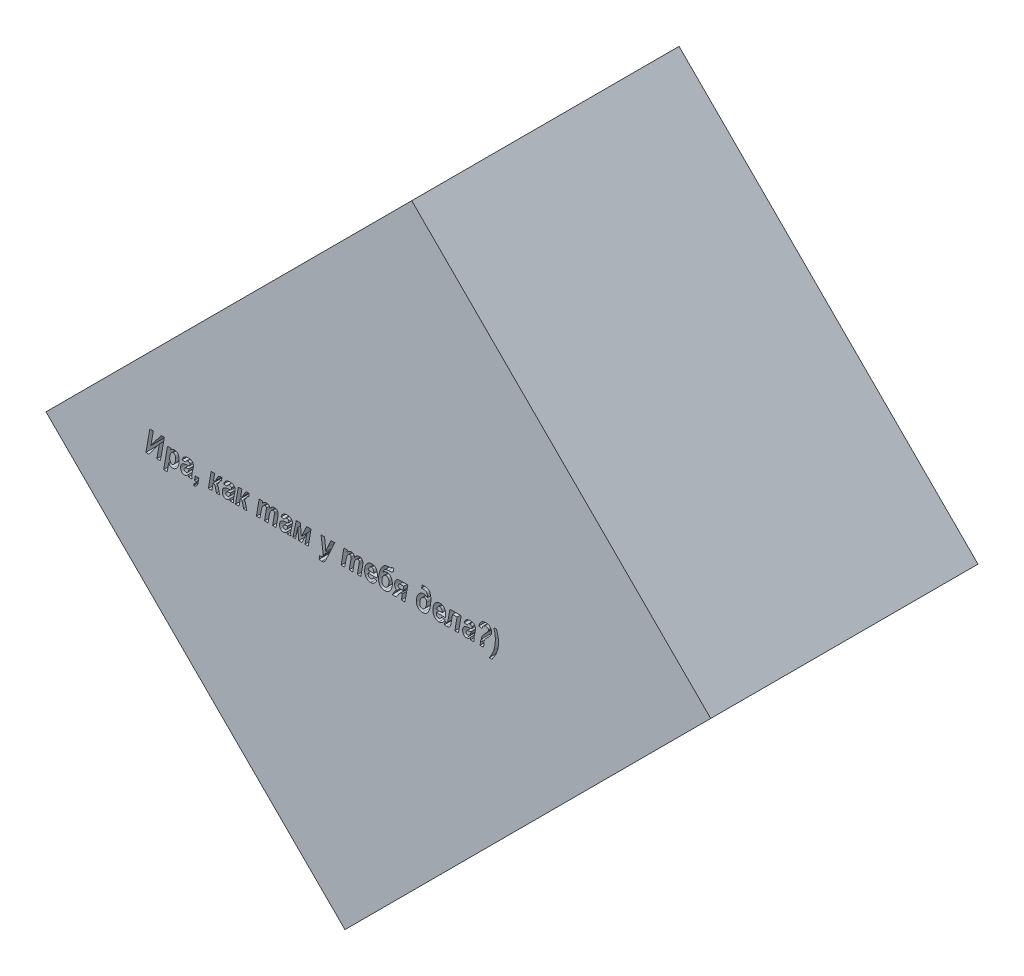
from build123d import *

# Parameters (mm, degrees)
EXTRUDE_1_DEPTH     = 0.5999988
CUT_EXTRUDE_1_DEPTH = 0.1


with BuildPart() as part:
    # Эскиз1 → Бобышка-Вытянуть1 (new body)
    with BuildSketch(Plane.XY.offset(0.5999988)):
        Polygon((0.07496556, 0.745998), (-0.74599546, -0.07496302), (-0.07496302, -0.74599546), (0.745998, 0.07496556), align=None)
    extrude(amount=-EXTRUDE_1_DEPTH)

    # Эскиз2 → Вырез-Вытянуть1 (cut)
    # profile 1 of 22: a face of its own
    with BuildSketch(Plane.XY.offset(0.5999988)):
        Polygon((-0.521784401, -0.041682097), (-0.512947144, 0.008317903), (-0.505043329, 0.008317903), (-0.510522226, -0.02268859), (-0.487652907, 0.008317903), (-0.480317274, 0.008317903), (-0.489205261, -0.041682097), (-0.497109076, -0.041682097), (-0.491528719, -0.010300197), (-0.514682128, -0.041682097), align=None)
    # profile 2 of 22: a face of its own
    with BuildSketch(Plane.XY.offset(0.5999988)):
        with BuildLine():
            Line((-0.47342807, -0.00531846), (-0.465534401, -0.00531846))
            Line((-0.465534401, -0.00531846), (-0.466204044, -0.009052227))
            add(Edge.make_bspline(
                [(-0.466204044, -0.009052227), (-0.465800626, -0.008650363), (-0.465038159, -0.007890835), (-0.463868303, -0.00690716), (-0.462748902, -0.006134661), (-0.461661811, -0.005558161), (-0.460582491, -0.005162091), (-0.459503628, -0.004871372), (-0.458396452, -0.00470885), (-0.457651368, -0.004682436), (-0.457275472, -0.00466911)],
                knots=[0, 0, 0, 0, 1.332088326, 2.517668254, 3.571333988, 4.509431312, 5.388483213, 6.256167972, 7.120235855, 8, 8, 8, 8], degree=3))
            add(Edge.make_bspline(
                [(-0.457275472, -0.00466911), (-0.45690607, -0.004680395), (-0.456179511, -0.004702591), (-0.455115982, -0.004890375), (-0.454109041, -0.005196102), (-0.453149209, -0.005612527), (-0.452257551, -0.006170947), (-0.451403059, -0.006829976), (-0.450627002, -0.007633748), (-0.449890749, -0.008536976), (-0.449225692, -0.009567291), (-0.448666293, -0.01073069), (-0.448174982, -0.012004867), (-0.447780862, -0.013404538), (-0.447484701, -0.014925788), (-0.447259713, -0.016568282), (-0.447128866, -0.018330381), (-0.447115801, -0.01954646), (-0.447109076, -0.020172356)],
                knots=[0, 0, 0, 0, 0.851603443, 1.674976278, 2.481962502, 3.274836362, 4.080275152, 4.902686578, 5.757713279, 6.650756446, 7.587729072, 8.578556558, 9.623113147, 10.734320131, 11.927653728, 13.19529691, 14.55646553, 16, 16, 16, 16], degree=3))
            add(Edge.make_bspline(
                [(-0.447109076, -0.020172356), (-0.44712489, -0.020981237), (-0.44715599, -0.022571983), (-0.447393878, -0.024904759), (-0.447775857, -0.02714095), (-0.448321602, -0.029276891), (-0.449036867, -0.03130986), (-0.44989152, -0.033250115), (-0.450897115, -0.035096857), (-0.451707084, -0.036234401), (-0.452111105, -0.036801821)],
                knots=[0, 0, 0, 0, 1.098446732, 2.160206979, 3.181201449, 4.177204749, 5.150536989, 6.104778995, 7.05464395, 8, 8, 8, 8], degree=3))
            add(Edge.make_bspline(
                [(-0.452111105, -0.036801821), (-0.452454319, -0.037241995), (-0.453118336, -0.038093602), (-0.454227956, -0.039218207), (-0.455373742, -0.040177082), (-0.456565844, -0.040973065), (-0.457816548, -0.041570415), (-0.459103617, -0.042018599), (-0.460444556, -0.042274043), (-0.461353191, -0.042312221), (-0.461810781, -0.042331447)],
                knots=[0, 0, 0, 0, 1.153873747, 2.232407181, 3.260780915, 4.240724797, 5.188857894, 6.120323798, 7.05339113, 8, 8, 8, 8], degree=3))
            add(Edge.make_bspline(
                [(-0.461810781, -0.042331447), (-0.462282026, -0.042316869), (-0.463200711, -0.042288449), (-0.464534769, -0.042037023), (-0.465782465, -0.041633217), (-0.466941762, -0.041059405), (-0.468008155, -0.040317282), (-0.468986843, -0.03941639), (-0.469879907, -0.038353406), (-0.470374015, -0.037549471), (-0.470627745, -0.037136642)],
                knots=[0, 0, 0, 0, 1.049439067, 2.045865735, 3.013598906, 3.964184354, 4.917604481, 5.899210581, 6.921222926, 8, 8, 8, 8], degree=3))
            Line((-0.470627745, -0.037136642), (-0.473986105, -0.05531846))
            Line((-0.473986105, -0.05531846), (-0.481879774, -0.05531846))
            Line((-0.481879774, -0.05531846), (-0.47342807, -0.00531846))
        make_face()
        with BuildLine():
            add(Edge.make_bspline(
                [(-0.468395602, -0.026341188), (-0.468388238, -0.026686237), (-0.468374, -0.027353389), (-0.468307617, -0.028326677), (-0.468175748, -0.029234909), (-0.467992758, -0.030086036), (-0.467760134, -0.030876543), (-0.46748297, -0.031612203), (-0.467127775, -0.032273783), (-0.466635649, -0.033065958), (-0.465921661, -0.03388331), (-0.464976131, -0.034633228), (-0.463941712, -0.035108425), (-0.46321552, -0.035162036), (-0.462855829, -0.03518859)],
                knots=[0, 0, 0, 0, 1.076672622, 2.081739874, 3.041189618, 3.937283891, 4.795299121, 5.610397712, 6.384373244, 7.133720764, 8.517357491, 9.743505873, 10.882335346, 12, 12, 12, 12], degree=3))
            add(Edge.make_bspline(
                [(-0.462855829, -0.03518859), (-0.462559549, -0.035170571), (-0.461957929, -0.035133981), (-0.461065088, -0.034839319), (-0.460192955, -0.034364288), (-0.45948744, -0.033831566), (-0.458928678, -0.033310312), (-0.458525982, -0.032810921), (-0.458119605, -0.032249158), (-0.457736784, -0.031598843), (-0.457349279, -0.030885183), (-0.456988855, -0.030083851), (-0.456618441, -0.029215369), (-0.456167643, -0.027942509), (-0.455653018, -0.026292991), (-0.45521758, -0.024259596), (-0.454958093, -0.022194794), (-0.454920302, -0.020808912), (-0.454901284, -0.02011148)],
                knots=[0, 0, 0, 0, 0.767703617, 1.558882257, 2.414931583, 3.336552172, 3.84563783, 4.394063499, 4.998107696, 5.643883669, 6.350718365, 7.104752575, 7.92307175, 8.80045448, 10.608010996, 12.403593692, 14.190143359, 16, 16, 16, 16], degree=3))
            add(Edge.make_bspline(
                [(-0.454901284, -0.02011148), (-0.454903067, -0.019786577), (-0.454906548, -0.019152572), (-0.454994266, -0.018235231), (-0.455111734, -0.017373629), (-0.455283051, -0.016572778), (-0.455504424, -0.015828475), (-0.455781497, -0.015143477), (-0.45609987, -0.014513236), (-0.456596197, -0.013785762), (-0.457279166, -0.013014824), (-0.458226153, -0.012313635), (-0.459287281, -0.011883729), (-0.460034812, -0.011835975), (-0.460410618, -0.011811967)],
                knots=[0, 0, 0, 0, 1.053033169, 2.054853315, 2.985410011, 3.87161294, 4.707748612, 5.499937283, 6.265096608, 6.992050083, 8.350905391, 9.583722302, 10.785266039, 12, 12, 12, 12], degree=3))
            add(Edge.make_bspline(
                [(-0.460410618, -0.011811967), (-0.460717057, -0.01182962), (-0.461335356, -0.011865239), (-0.46224692, -0.012159928), (-0.463137062, -0.012627882), (-0.464026601, -0.013273079), (-0.464876544, -0.014175799), (-0.465656802, -0.015363453), (-0.466408336, -0.016828927), (-0.467079881, -0.018544442), (-0.467662451, -0.020417949), (-0.468086826, -0.02236598), (-0.468351653, -0.024345222), (-0.468380914, -0.025674108), (-0.468395602, -0.026341188)],
                knots=[0, 0, 0, 0, 0.610401113, 1.231600078, 1.892616086, 2.61205983, 3.413976919, 4.351737584, 5.438342093, 6.695281291, 8.023019601, 9.349385146, 10.669434834, 12, 12, 12, 12], degree=3))
        make_face(mode=Mode.SUBTRACT)
    # profile 3 of 22: a face of its own
    with BuildSketch(Plane.XY.offset(0.5999988)):
        with BuildLine():
            Line((-0.432823362, -0.016357421), (-0.44061557, -0.015708071))
            add(Edge.make_bspline(
                [(-0.44061557, -0.015708071), (-0.440489166, -0.015270052), (-0.440241677, -0.014412441), (-0.439784514, -0.013179923), (-0.439255757, -0.012031699), (-0.438666807, -0.010962817), (-0.438017705, -0.009970987), (-0.437290823, -0.009063995), (-0.436503943, -0.008231138), (-0.435644548, -0.007487797), (-0.434726612, -0.006822094), (-0.433743659, -0.00624695), (-0.432702398, -0.005754354), (-0.431602355, -0.005363916), (-0.430447681, -0.005042462), (-0.429231569, -0.00482533), (-0.427956389, -0.004688648), (-0.427087794, -0.004675713), (-0.426644385, -0.00466911)],
                knots=[0, 0, 0, 0, 1.129098089, 2.210695216, 3.252861694, 4.257859567, 5.231496705, 6.185359358, 7.133538715, 8.06592922, 8.996058467, 9.938669203, 10.883139795, 11.845172649, 12.826886922, 13.849025235, 14.901946516, 16, 16, 16, 16], degree=3))
            add(Edge.make_bspline(
                [(-0.426644385, -0.00466911), (-0.426194325, -0.004676699), (-0.425319524, -0.00469145), (-0.424046784, -0.004811237), (-0.422856287, -0.00502473), (-0.421745629, -0.005317296), (-0.420714814, -0.005691458), (-0.419764873, -0.006153135), (-0.418884651, -0.006684347), (-0.418106732, -0.007322518), (-0.417402032, -0.008010998), (-0.416786239, -0.008763086), (-0.416285915, -0.009582972), (-0.415846333, -0.010438216), (-0.415526244, -0.011361504), (-0.415290336, -0.012336208), (-0.415161903, -0.013367701), (-0.415139824, -0.014070846), (-0.415128557, -0.014429662)],
                knots=[0, 0, 0, 0, 1.264499663, 2.45786338, 3.587507987, 4.659393616, 5.681597277, 6.663422877, 7.623436193, 8.562910056, 9.483545924, 10.38889903, 11.285430949, 12.177924414, 13.085668422, 14.023795506, 14.991538711, 16, 16, 16, 16], degree=3))
            add(Edge.make_bspline(
                [(-0.415128557, -0.014429662), (-0.415144369, -0.014971248), (-0.415177082, -0.016091683), (-0.415332427, -0.017387044), (-0.415504648, -0.01838034), (-0.415635229, -0.019111795), (-0.415818435, -0.020031726), (-0.416058089, -0.021142397), (-0.41632474, -0.022446753), (-0.416657733, -0.023942488), (-0.417015597, -0.025632466), (-0.417281659, -0.02682171), (-0.417421576, -0.027447113)],
                knots=[0, 0, 0, 0, 1.227250283, 2.538941867, 2.950894083, 3.511550173, 4.22239263, 5.076050429, 6.08599568, 7.238835539, 8.547950454, 10, 10, 10, 10], degree=3))
            add(Edge.make_bspline(
                [(-0.417421576, -0.027447113), (-0.417538876, -0.027967458), (-0.417764701, -0.028969223), (-0.418052093, -0.030415566), (-0.418313225, -0.031736081), (-0.418512145, -0.032934775), (-0.418681506, -0.034009164), (-0.418789111, -0.034964095), (-0.418870515, -0.035795965), (-0.418878804, -0.036311269), (-0.418882615, -0.036548168)],
                knots=[0, 0, 0, 0, 1.386672492, 2.669612582, 3.833598052, 4.885925024, 5.828500974, 6.660647554, 7.384265091, 8, 8, 8, 8], degree=3))
            add(Edge.make_bspline(
                [(-0.418882615, -0.036548168), (-0.418872632, -0.036951128), (-0.418852179, -0.037776667), (-0.41868661, -0.039036493), (-0.418449787, -0.04034999), (-0.418212803, -0.041230402), (-0.418091219, -0.041682097)],
                knots=[0, 0, 0, 0, 0.927846233, 1.900867314, 2.923041175, 4, 4, 4, 4], degree=3))
            Line((-0.418091219, -0.041682097), (-0.426319709, -0.041682097))
            add(Edge.make_bspline(
                [(-0.426319709, -0.041682097), (-0.426471198, -0.041001343), (-0.426776483, -0.039629471), (-0.426884304, -0.038228149), (-0.426938622, -0.037522194)],
                knots=[0, 0, 0, 0, 0.99244519, 2, 2, 2, 2], degree=3))
            add(Edge.make_bspline(
                [(-0.426938622, -0.037522194), (-0.427232001, -0.03789409), (-0.427808513, -0.038624895), (-0.428788197, -0.039588538), (-0.429830791, -0.04042111), (-0.430929109, -0.041104887), (-0.432058523, -0.041648571), (-0.433196715, -0.042033375), (-0.434334648, -0.042281747), (-0.435094881, -0.042314983), (-0.435471495, -0.042331447)],
                knots=[0, 0, 0, 0, 1.119965678, 2.200820209, 3.243185299, 4.271321593, 5.255700705, 6.202200965, 7.109383101, 8, 8, 8, 8], degree=3))
            add(Edge.make_bspline(
                [(-0.435471495, -0.042331447), (-0.435762877, -0.042324753), (-0.436335253, -0.042311602), (-0.437176127, -0.042174613), (-0.437978634, -0.041951695), (-0.438745958, -0.041642571), (-0.43948653, -0.041257354), (-0.440182434, -0.040765986), (-0.440845163, -0.040195155), (-0.441464653, -0.039543663), (-0.442031799, -0.038820203), (-0.442515142, -0.038022443), (-0.442939662, -0.037177471), (-0.443266396, -0.036264744), (-0.443550715, -0.035302443), (-0.443722012, -0.034273471), (-0.443838994, -0.033192515), (-0.443854417, -0.032452867), (-0.443862323, -0.032073736)],
                knots=[0, 0, 0, 0, 0.942279964, 1.850971306, 2.748520778, 3.632623055, 4.523675982, 5.44363469, 6.382667269, 7.350348476, 8.348677999, 9.351078932, 10.364296385, 11.40319854, 12.484143614, 13.606997648, 14.77338839, 16, 16, 16, 16], degree=3))
            add(Edge.make_bspline(
                [(-0.443862323, -0.032073736), (-0.443856762, -0.031640392), (-0.443845911, -0.030794871), (-0.44369715, -0.029567198), (-0.443474031, -0.028414394), (-0.443181133, -0.027334058), (-0.442761643, -0.02634135), (-0.4422807, -0.025414374), (-0.441702301, -0.024561522), (-0.441241012, -0.024063064), (-0.441011268, -0.023814808)],
                knots=[0, 0, 0, 0, 1.159520601, 2.262403985, 3.304754161, 4.302211498, 5.252226539, 6.183767543, 7.095427099, 8, 8, 8, 8], degree=3))
            add(Edge.make_bspline(
                [(-0.441011268, -0.023814808), (-0.44076394, -0.023577166), (-0.440258423, -0.023091445), (-0.439354932, -0.022489401), (-0.438350822, -0.021941084), (-0.437227262, -0.02146198), (-0.435981919, -0.021070586), (-0.434617264, -0.020752299), (-0.433138553, -0.020481851), (-0.432107365, -0.020378081), (-0.431575391, -0.020324548)],
                knots=[0, 0, 0, 0, 0.800701781, 1.636568807, 2.528481579, 3.474576453, 4.487596792, 5.577224534, 6.750128382, 8, 8, 8, 8], degree=3))
            add(Edge.make_bspline(
                [(-0.431575391, -0.020324548), (-0.431108486, -0.020278925), (-0.430214459, -0.020191566), (-0.428935841, -0.020039139), (-0.427778461, -0.019879482), (-0.426744167, -0.019704966), (-0.425826102, -0.019535403), (-0.425029278, -0.019357848), (-0.424352502, -0.019165103), (-0.423948286, -0.019020943), (-0.423762891, -0.018954824)],
                knots=[0, 0, 0, 0, 1.416098646, 2.711538931, 3.886792793, 4.942493366, 5.877567558, 6.704763392, 7.405934338, 8, 8, 8, 8], degree=3))
            add(Edge.make_bspline(
                [(-0.423762891, -0.018954824), (-0.42366901, -0.018576654), (-0.423492028, -0.017863735), (-0.423281304, -0.016850431), (-0.423165401, -0.015954271), (-0.423143806, -0.015397174), (-0.423133833, -0.015139889)],
                knots=[0, 0, 0, 0, 1.206438364, 2.274354778, 3.203043038, 4, 4, 4, 4], degree=3))
            add(Edge.make_bspline(
                [(-0.423133833, -0.015139889), (-0.423145672, -0.014901232), (-0.423168742, -0.014436192), (-0.423402326, -0.013780421), (-0.423783659, -0.013205608), (-0.424296952, -0.012705414), (-0.424938945, -0.012299672), (-0.425696022, -0.012018761), (-0.426551904, -0.011843761), (-0.427157528, -0.011822932), (-0.427476365, -0.011811967)],
                knots=[0, 0, 0, 0, 0.930933205, 1.813984927, 2.683850068, 3.610257746, 4.597783437, 5.632418024, 6.753562344, 8, 8, 8, 8], degree=3))
            add(Edge.make_bspline(
                [(-0.427476365, -0.011811967), (-0.42782591, -0.011824219), (-0.428494963, -0.011847671), (-0.429443774, -0.012063192), (-0.430285202, -0.012421648), (-0.431019468, -0.012929258), (-0.431649346, -0.013579414), (-0.432156625, -0.014380142), (-0.432569535, -0.015312956), (-0.432736212, -0.015998811), (-0.432823362, -0.016357421)],
                knots=[0, 0, 0, 0, 1.086788895, 2.080189215, 3.009079742, 3.917218407, 4.840364644, 5.806850184, 6.853274405, 8, 8, 8, 8], degree=3))
        make_face()
        with BuildLine():
            add(Edge.make_bspline(
                [(-0.425081885, -0.02544833), (-0.425365176, -0.025522985), (-0.425998186, -0.025689799), (-0.426643167, -0.025802214), (-0.426999498, -0.025864321)],
                knots=[0, 0, 0, 0, 0.895062502, 2, 2, 2, 2], degree=3))
            add(Edge.make_bspline(
                [(-0.426999498, -0.025864321), (-0.427442811, -0.025930166), (-0.428290365, -0.026056054), (-0.429499869, -0.026264513), (-0.430587964, -0.026501719), (-0.431562285, -0.026737876), (-0.432419443, -0.027002331), (-0.43316133, -0.027280754), (-0.433783613, -0.027582975), (-0.434439674, -0.027994191), (-0.435094138, -0.028581266), (-0.435655712, -0.029415413), (-0.436014446, -0.030361896), (-0.436051144, -0.031035549), (-0.436070115, -0.031383801)],
                knots=[0, 0, 0, 0, 1.381050292, 2.640384628, 3.780967977, 4.812233681, 5.728624639, 6.543445371, 7.251885016, 7.856158764, 8.925936026, 9.931823992, 10.930832067, 12, 12, 12, 12], degree=3))
            add(Edge.make_bspline(
                [(-0.436070115, -0.031383801), (-0.436060845, -0.031655786), (-0.436043083, -0.03217695), (-0.435839527, -0.032916303), (-0.435524245, -0.033576286), (-0.435087105, -0.03414932), (-0.434544971, -0.034602769), (-0.433937569, -0.03495276), (-0.433247262, -0.035145863), (-0.432766987, -0.03517404), (-0.432518979, -0.03518859)],
                knots=[0, 0, 0, 0, 1.116977401, 2.140302576, 3.130411205, 4.113446135, 5.081478085, 6.022705284, 6.978950569, 8, 8, 8, 8], degree=3))
            add(Edge.make_bspline(
                [(-0.432518979, -0.03518859), (-0.432250634, -0.035181043), (-0.431714975, -0.035165979), (-0.430931125, -0.034975186), (-0.430157288, -0.03471924), (-0.429420625, -0.034326806), (-0.428724718, -0.03384434), (-0.428087888, -0.033270344), (-0.427525618, -0.032606687), (-0.427033382, -0.031823982), (-0.426587741, -0.030868673), (-0.426159632, -0.029693987), (-0.425748093, -0.0282651), (-0.425506216, -0.027225186), (-0.425376122, -0.026665863)],
                knots=[0, 0, 0, 0, 0.792096971, 1.581154223, 2.375460321, 3.198979456, 4.040063202, 4.876072039, 5.728096691, 6.605309759, 7.60340704, 8.84134769, 10.301100005, 12, 12, 12, 12], degree=3))
            Line((-0.425376122, -0.026665863), (-0.425081885, -0.02544833))
        make_face(mode=Mode.SUBTRACT)
    # profile 4 of 22: a face of its own
    with BuildSketch(Plane.XY.offset(0.5999988)):
        with BuildLine():
            Line((-0.411049823, -0.031941837), (-0.402953232, -0.031941837))
            Line((-0.402953232, -0.031941837), (-0.404302664, -0.039997843))
            add(Edge.make_bspline(
                [(-0.404302664, -0.039997843), (-0.404403023, -0.04056013), (-0.40459666, -0.041645022), (-0.404949276, -0.043200682), (-0.405354152, -0.044622835), (-0.405801879, -0.045916393), (-0.406278184, -0.047086473), (-0.406823335, -0.048117206), (-0.407394907, -0.049029601), (-0.408031099, -0.049807944), (-0.408711801, -0.050472697), (-0.40942187, -0.051060066), (-0.410189172, -0.05154569), (-0.410994246, -0.051953556), (-0.411841992, -0.052284563), (-0.412738911, -0.052511948), (-0.413675927, -0.052669099), (-0.414316247, -0.052703554), (-0.414641544, -0.052721058)],
                knots=[0, 0, 0, 0, 1.519503382, 2.931771717, 4.241911649, 5.451308229, 6.572607393, 7.598940649, 8.549931502, 9.432477377, 10.266002519, 11.078275321, 11.879508569, 12.676283167, 13.476707599, 14.295137081, 15.133891172, 16, 16, 16, 16], degree=3))
            Line((-0.414641544, -0.052721058), (-0.413850148, -0.048175603))
            add(Edge.make_bspline(
                [(-0.413850148, -0.048175603), (-0.413528487, -0.048073536), (-0.412900657, -0.047874319), (-0.41204493, -0.047423389), (-0.411294204, -0.046865791), (-0.410648812, -0.046177777), (-0.410099232, -0.045325601), (-0.409642949, -0.044289253), (-0.409242059, -0.043059879), (-0.409064578, -0.042161491), (-0.408969872, -0.041682097)],
                knots=[0, 0, 0, 0, 0.933980231, 1.822977803, 2.666730036, 3.51567464, 4.42316542, 5.463624242, 6.646550295, 8, 8, 8, 8], degree=3))
            Line((-0.408969872, -0.041682097), (-0.412693492, -0.041682097))
            Line((-0.412693492, -0.041682097), (-0.411049823, -0.031941837))
        make_face()
    # profile 5 of 22: a face of its own
    with BuildSketch(Plane.XY.offset(0.5999988)):
        with BuildLine():
            Line((-0.381626122, -0.041682097), (-0.375294953, -0.00531846))
            Line((-0.375294953, -0.00531846), (-0.367391138, -0.00531846))
            Line((-0.367391138, -0.00531846), (-0.370100148, -0.020902876))
            add(Edge.make_bspline(
                [(-0.370100148, -0.020902876), (-0.369808959, -0.020894901), (-0.369247996, -0.020879537), (-0.368441384, -0.020767806), (-0.367709702, -0.020585495), (-0.367124913, -0.020373889), (-0.366686862, -0.020069589), (-0.36632946, -0.019712279), (-0.365947189, -0.01921838), (-0.36553933, -0.018588949), (-0.36509126, -0.017834866), (-0.364614396, -0.016947872), (-0.36411067, -0.015924144), (-0.36359062, -0.014796096), (-0.363068408, -0.013640582), (-0.362520851, -0.012544293), (-0.362014315, -0.01151868), (-0.361497385, -0.010585208), (-0.361021274, -0.00972091), (-0.36053562, -0.008949931), (-0.360087551, -0.00824818), (-0.359635666, -0.007627031), (-0.359167955, -0.007079584), (-0.358656938, -0.006609981), (-0.358104055, -0.006207543), (-0.357502165, -0.00588381), (-0.356855643, -0.00562733), (-0.356164732, -0.005443765), (-0.355428265, -0.005346041), (-0.354925218, -0.005327793), (-0.354667924, -0.00531846)],
                knots=[0, 0, 0, 0, 1.036699583, 1.997165704, 2.890846003, 3.722677644, 4.190289904, 4.777867078, 5.51506654, 6.410124913, 7.446824495, 8.637546103, 9.994622123, 11.50847081, 13.060159727, 14.508813158, 15.871274316, 17.132142632, 18.307605412, 19.383631197, 20.375586597, 21.271535535, 22.116597073, 22.934719162, 23.736821777, 24.545047403, 25.361217565, 26.208250045, 27.083569584, 28, 28, 28, 28], degree=3))
            Line((-0.354667924, -0.00531846), (-0.35100518, -0.00531846))
            Line((-0.35100518, -0.00531846), (-0.352050229, -0.012461317))
            add(Edge.make_bspline(
                [(-0.352050229, -0.012461317), (-0.353099269, -0.012469175), (-0.353426435, -0.012484631), (-0.353899003, -0.012604621), (-0.354323308, -0.012826442), (-0.354725101, -0.013140111), (-0.355117712, -0.013613139), (-0.355522486, -0.01428642), (-0.355990848, -0.015167235), (-0.356283178, -0.015844153), (-0.356443492, -0.016215376)],
                knots=[0, 0, 0, 0, 0.726623802, 1.429251901, 2.11009021, 2.804902404, 3.643327587, 4.779169828, 6.23369455, 8, 8, 8, 8], degree=3))
            add(Edge.make_bspline(
                [(-0.356443492, -0.016215376), (-0.356667599, -0.016678322), (-0.357101768, -0.017575202), (-0.35782731, -0.018827104), (-0.358612698, -0.01992753), (-0.35943434, -0.020892738), (-0.360310273, -0.021708925), (-0.361230028, -0.022387656), (-0.362197526, -0.022926918), (-0.362882306, -0.023167959), (-0.363221089, -0.02328721)],
                knots=[0, 0, 0, 0, 1.222895799, 2.369154308, 3.435911279, 4.433872333, 5.378524948, 6.276129069, 7.147144866, 8, 8, 8, 8], degree=3))
            add(Edge.make_bspline(
                [(-0.363221089, -0.02328721), (-0.362979861, -0.02336501), (-0.36249037, -0.023522879), (-0.361825211, -0.023956586), (-0.361221082, -0.024530518), (-0.360656859, -0.02523649), (-0.360166747, -0.02610084), (-0.359722206, -0.027100815), (-0.359326568, -0.028241728), (-0.359119133, -0.029058544), (-0.359010456, -0.02948648)],
                knots=[0, 0, 0, 0, 0.771615242, 1.565735247, 2.399217668, 3.311011427, 4.31589584, 5.425945274, 6.651433896, 8, 8, 8, 8], degree=3))
            Line((-0.359010456, -0.02948648), (-0.356199985, -0.041682097))
            Line((-0.356199985, -0.041682097), (-0.363495034, -0.041682097))
            Line((-0.363495034, -0.041682097), (-0.365980829, -0.03091708))
            add(Edge.make_bspline(
                [(-0.365980829, -0.03091708), (-0.366103196, -0.030468886), (-0.366328995, -0.029641845), (-0.366724572, -0.028533086), (-0.367148838, -0.027665423), (-0.367602207, -0.026991491), (-0.368201355, -0.026512673), (-0.368978332, -0.026227184), (-0.369932466, -0.026086761), (-0.370627278, -0.026093847), (-0.371003151, -0.026097681)],
                knots=[0, 0, 0, 0, 1.417196593, 2.615117709, 3.584067912, 4.360065293, 5.072259797, 5.882679047, 6.854590898, 8, 8, 8, 8], degree=3))
            Line((-0.371003151, -0.026097681), (-0.373722307, -0.041682097))
            Line((-0.373722307, -0.041682097), (-0.381626122, -0.041682097))
        make_face()
    # profile 6 of 22: a face of its own
    with BuildSketch(Plane.XY.offset(0.5999988)):
        with BuildLine():
            Line((-0.339316868, -0.016357421), (-0.347109076, -0.015708071))
            add(Edge.make_bspline(
                [(-0.347109076, -0.015708071), (-0.346982673, -0.015270052), (-0.346735184, -0.014412441), (-0.34627802, -0.013179923), (-0.345749264, -0.012031699), (-0.345160314, -0.010962817), (-0.344511212, -0.009970987), (-0.34378433, -0.009063995), (-0.34299745, -0.008231138), (-0.342138055, -0.007487797), (-0.341220119, -0.006822094), (-0.340237165, -0.00624695), (-0.339195904, -0.005754354), (-0.338095861, -0.005363916), (-0.336941188, -0.005042462), (-0.335725075, -0.00482533), (-0.334449896, -0.004688648), (-0.333581301, -0.004675713), (-0.333137891, -0.00466911)],
                knots=[0, 0, 0, 0, 1.129098089, 2.210695216, 3.252861694, 4.257859567, 5.231496705, 6.185359358, 7.133538715, 8.06592922, 8.996058467, 9.938669203, 10.883139795, 11.845172649, 12.826886922, 13.849025235, 14.901946516, 16, 16, 16, 16], degree=3))
            add(Edge.make_bspline(
                [(-0.333137891, -0.00466911), (-0.332687831, -0.004676699), (-0.33181303, -0.00469145), (-0.33054029, -0.004811237), (-0.329349793, -0.00502473), (-0.328239136, -0.005317296), (-0.327208321, -0.005691458), (-0.326258379, -0.006153135), (-0.325378158, -0.006684347), (-0.324600238, -0.007322518), (-0.323895539, -0.008010998), (-0.323279746, -0.008763086), (-0.322779422, -0.009582972), (-0.32233984, -0.010438216), (-0.32201975, -0.011361504), (-0.321783843, -0.012336208), (-0.321655409, -0.013367701), (-0.32163333, -0.014070846), (-0.321622063, -0.014429662)],
                knots=[0, 0, 0, 0, 1.264499663, 2.45786338, 3.587507987, 4.659393616, 5.681597277, 6.663422877, 7.623436193, 8.562910056, 9.483545924, 10.38889903, 11.285430949, 12.177924414, 13.085668422, 14.023795506, 14.991538711, 16, 16, 16, 16], degree=3))
            add(Edge.make_bspline(
                [(-0.321622063, -0.014429662), (-0.321637876, -0.014971248), (-0.321670588, -0.016091683), (-0.321825934, -0.017387044), (-0.321998155, -0.01838034), (-0.322128736, -0.019111795), (-0.322311942, -0.020031726), (-0.322551595, -0.021142397), (-0.322818247, -0.022446753), (-0.323151239, -0.023942488), (-0.323509103, -0.025632466), (-0.323775165, -0.02682171), (-0.323915083, -0.027447113)],
                knots=[0, 0, 0, 0, 1.227250283, 2.538941867, 2.950894083, 3.511550173, 4.22239263, 5.076050429, 6.08599568, 7.238835539, 8.547950454, 10, 10, 10, 10], degree=3))
            add(Edge.make_bspline(
                [(-0.323915083, -0.027447113), (-0.324032383, -0.027967458), (-0.324258208, -0.028969223), (-0.324545599, -0.030415566), (-0.324806731, -0.031736081), (-0.325005652, -0.032934775), (-0.325175013, -0.034009164), (-0.325282617, -0.034964095), (-0.325364021, -0.035795965), (-0.325372311, -0.036311269), (-0.325376122, -0.036548168)],
                knots=[0, 0, 0, 0, 1.386672492, 2.669612582, 3.833598052, 4.885925024, 5.828500974, 6.660647554, 7.384265091, 8, 8, 8, 8], degree=3))
            add(Edge.make_bspline(
                [(-0.325376122, -0.036548168), (-0.325366138, -0.036951128), (-0.325345685, -0.037776667), (-0.325180117, -0.039036493), (-0.324943294, -0.04034999), (-0.32470631, -0.041230402), (-0.324584726, -0.041682097)],
                knots=[0, 0, 0, 0, 0.927846233, 1.900867314, 2.923041175, 4, 4, 4, 4], degree=3))
            Line((-0.324584726, -0.041682097), (-0.332813216, -0.041682097))
            add(Edge.make_bspline(
                [(-0.332813216, -0.041682097), (-0.332964705, -0.041001343), (-0.333269989, -0.039629471), (-0.33337781, -0.038228149), (-0.333432128, -0.037522194)],
                knots=[0, 0, 0, 0, 0.99244519, 2, 2, 2, 2], degree=3))
            add(Edge.make_bspline(
                [(-0.333432128, -0.037522194), (-0.333725507, -0.03789409), (-0.33430202, -0.038624895), (-0.335281703, -0.039588538), (-0.336324297, -0.04042111), (-0.337422616, -0.041104887), (-0.338552029, -0.041648571), (-0.339690222, -0.042033375), (-0.340828154, -0.042281747), (-0.341588387, -0.042314983), (-0.341965002, -0.042331447)],
                knots=[0, 0, 0, 0, 1.119965678, 2.200820209, 3.243185299, 4.271321593, 5.255700705, 6.202200965, 7.109383101, 8, 8, 8, 8], degree=3))
            add(Edge.make_bspline(
                [(-0.341965002, -0.042331447), (-0.342256383, -0.042324753), (-0.34282876, -0.042311602), (-0.343669633, -0.042174613), (-0.34447214, -0.041951695), (-0.345239464, -0.041642571), (-0.345980037, -0.041257354), (-0.34667594, -0.040765986), (-0.34733867, -0.040195155), (-0.347958159, -0.039543663), (-0.348525306, -0.038820203), (-0.349008648, -0.038022443), (-0.349433168, -0.037177471), (-0.349759903, -0.036264744), (-0.350044221, -0.035302443), (-0.350215519, -0.034273471), (-0.350332501, -0.033192515), (-0.350347924, -0.032452867), (-0.350355829, -0.032073736)],
                knots=[0, 0, 0, 0, 0.942279964, 1.850971306, 2.748520778, 3.632623055, 4.523675982, 5.44363469, 6.382667269, 7.350348476, 8.348677999, 9.351078932, 10.364296385, 11.40319854, 12.484143614, 13.606997648, 14.77338839, 16, 16, 16, 16], degree=3))
            add(Edge.make_bspline(
                [(-0.350355829, -0.032073736), (-0.350350268, -0.031640392), (-0.350339417, -0.030794871), (-0.350190656, -0.029567198), (-0.349967537, -0.028414394), (-0.34967464, -0.027334058), (-0.34925515, -0.02634135), (-0.348774207, -0.025414374), (-0.348195807, -0.024561522), (-0.347734519, -0.024063064), (-0.347504774, -0.023814808)],
                knots=[0, 0, 0, 0, 1.159520601, 2.262403985, 3.304754161, 4.302211498, 5.252226539, 6.183767543, 7.095427099, 8, 8, 8, 8], degree=3))
            add(Edge.make_bspline(
                [(-0.347504774, -0.023814808), (-0.347257447, -0.023577166), (-0.346751929, -0.023091445), (-0.345848439, -0.022489401), (-0.344844329, -0.021941084), (-0.343720769, -0.02146198), (-0.342475426, -0.021070586), (-0.34111077, -0.020752299), (-0.339632059, -0.020481851), (-0.338600871, -0.020378081), (-0.338068898, -0.020324548)],
                knots=[0, 0, 0, 0, 0.800701781, 1.636568807, 2.528481579, 3.474576453, 4.487596792, 5.577224534, 6.750128382, 8, 8, 8, 8], degree=3))
            add(Edge.make_bspline(
                [(-0.338068898, -0.020324548), (-0.337601993, -0.020278925), (-0.336707965, -0.020191566), (-0.335429347, -0.020039139), (-0.334271967, -0.019879482), (-0.333237673, -0.019704966), (-0.332319608, -0.019535403), (-0.331522784, -0.019357848), (-0.330846009, -0.019165103), (-0.330441793, -0.019020943), (-0.330256398, -0.018954824)],
                knots=[0, 0, 0, 0, 1.416098646, 2.711538931, 3.886792793, 4.942493366, 5.877567558, 6.704763392, 7.405934338, 8, 8, 8, 8], degree=3))
            add(Edge.make_bspline(
                [(-0.330256398, -0.018954824), (-0.330162517, -0.018576654), (-0.329985535, -0.017863735), (-0.329774811, -0.016850431), (-0.329658907, -0.015954271), (-0.329637312, -0.015397174), (-0.329627339, -0.015139889)],
                knots=[0, 0, 0, 0, 1.206438364, 2.274354778, 3.203043038, 4, 4, 4, 4], degree=3))
            add(Edge.make_bspline(
                [(-0.329627339, -0.015139889), (-0.329639179, -0.014901232), (-0.329662249, -0.014436192), (-0.329895832, -0.013780421), (-0.330277165, -0.013205608), (-0.330790458, -0.012705414), (-0.331432451, -0.012299672), (-0.332189528, -0.012018761), (-0.33304541, -0.011843761), (-0.333651035, -0.011822932), (-0.333969872, -0.011811967)],
                knots=[0, 0, 0, 0, 0.930933205, 1.813984927, 2.683850068, 3.610257746, 4.597783437, 5.632418024, 6.753562344, 8, 8, 8, 8], degree=3))
            add(Edge.make_bspline(
                [(-0.333969872, -0.011811967), (-0.334319416, -0.011824219), (-0.334988469, -0.011847671), (-0.33593728, -0.012063192), (-0.336778709, -0.012421648), (-0.337512975, -0.012929258), (-0.338142853, -0.013579414), (-0.338650132, -0.014380142), (-0.339063042, -0.015312956), (-0.339229719, -0.015998811), (-0.339316868, -0.016357421)],
                knots=[0, 0, 0, 0, 1.086788895, 2.080189215, 3.009079742, 3.917218407, 4.840364644, 5.806850184, 6.853274405, 8, 8, 8, 8], degree=3))
        make_face()
        with BuildLine():
            add(Edge.make_bspline(
                [(-0.331575391, -0.02544833), (-0.331858683, -0.025522985), (-0.332491693, -0.025689799), (-0.333136673, -0.025802214), (-0.333493005, -0.025864321)],
                knots=[0, 0, 0, 0, 0.895062502, 2, 2, 2, 2], degree=3))
            add(Edge.make_bspline(
                [(-0.333493005, -0.025864321), (-0.333936317, -0.025930166), (-0.334783871, -0.026056054), (-0.335993376, -0.026264513), (-0.337081471, -0.026501719), (-0.338055791, -0.026737876), (-0.33891295, -0.027002331), (-0.339654836, -0.027280754), (-0.340277119, -0.027582975), (-0.340933181, -0.027994191), (-0.341587644, -0.028581266), (-0.342149219, -0.029415413), (-0.342507953, -0.030361896), (-0.34254465, -0.031035549), (-0.342563622, -0.031383801)],
                knots=[0, 0, 0, 0, 1.381050292, 2.640384628, 3.780967977, 4.812233681, 5.728624639, 6.543445371, 7.251885016, 7.856158764, 8.925936026, 9.931823992, 10.930832067, 12, 12, 12, 12], degree=3))
            add(Edge.make_bspline(
                [(-0.342563622, -0.031383801), (-0.342554352, -0.031655786), (-0.34253659, -0.03217695), (-0.342333033, -0.032916303), (-0.342017751, -0.033576286), (-0.341580611, -0.03414932), (-0.341038478, -0.034602769), (-0.340431075, -0.03495276), (-0.339740768, -0.035145863), (-0.339260493, -0.03517404), (-0.339012485, -0.03518859)],
                knots=[0, 0, 0, 0, 1.116977401, 2.140302576, 3.130411205, 4.113446135, 5.081478085, 6.022705284, 6.978950569, 8, 8, 8, 8], degree=3))
            add(Edge.make_bspline(
                [(-0.339012485, -0.03518859), (-0.338744141, -0.035181043), (-0.338208481, -0.035165979), (-0.337424631, -0.034975186), (-0.336650794, -0.03471924), (-0.335914132, -0.034326806), (-0.335218225, -0.03384434), (-0.334581395, -0.033270344), (-0.334019125, -0.032606687), (-0.333526888, -0.031823982), (-0.333081248, -0.030868673), (-0.332653139, -0.029693987), (-0.3322416, -0.0282651), (-0.331999723, -0.027225186), (-0.331869628, -0.026665863)],
                knots=[0, 0, 0, 0, 0.792096971, 1.581154223, 2.375460321, 3.198979456, 4.040063202, 4.876072039, 5.728096691, 6.605309759, 7.60340704, 8.84134769, 10.301100005, 12, 12, 12, 12], degree=3))
            Line((-0.331869628, -0.026665863), (-0.331575391, -0.02544833))
        make_face(mode=Mode.SUBTRACT)
    # profile 7 of 22: a face of its own
    with BuildSketch(Plane.XY.offset(0.5999988)):
        with BuildLine():
            Line((-0.320587161, -0.041682097), (-0.314255992, -0.00531846))
            Line((-0.314255992, -0.00531846), (-0.306352177, -0.00531846))
            Line((-0.306352177, -0.00531846), (-0.309061187, -0.020902876))
            add(Edge.make_bspline(
                [(-0.309061187, -0.020902876), (-0.308769998, -0.020894901), (-0.308209035, -0.020879537), (-0.307402423, -0.020767806), (-0.306670741, -0.020585495), (-0.306085952, -0.020373889), (-0.305647901, -0.020069589), (-0.305290499, -0.019712279), (-0.304908228, -0.01921838), (-0.304500369, -0.018588949), (-0.304052299, -0.017834866), (-0.303575435, -0.016947872), (-0.303071709, -0.015924144), (-0.302551659, -0.014796096), (-0.302029447, -0.013640582), (-0.301481889, -0.012544293), (-0.300975354, -0.01151868), (-0.300458424, -0.010585208), (-0.299982313, -0.00972091), (-0.299496659, -0.008949931), (-0.29904859, -0.00824818), (-0.298596705, -0.007627031), (-0.298128994, -0.007079584), (-0.297617976, -0.006609981), (-0.297065094, -0.006207543), (-0.296463204, -0.00588381), (-0.295816682, -0.00562733), (-0.295125771, -0.005443765), (-0.294389304, -0.005346041), (-0.293886257, -0.005327793), (-0.293628963, -0.00531846)],
                knots=[0, 0, 0, 0, 1.036699583, 1.997165704, 2.890846003, 3.722677644, 4.190289904, 4.777867078, 5.51506654, 6.410124913, 7.446824495, 8.637546103, 9.994622123, 11.50847081, 13.060159727, 14.508813158, 15.871274316, 17.132142632, 18.307605412, 19.383631197, 20.375586597, 21.271535535, 22.116597073, 22.934719162, 23.736821777, 24.545047403, 25.361217565, 26.208250045, 27.083569584, 28, 28, 28, 28], degree=3))
            Line((-0.293628963, -0.00531846), (-0.289966219, -0.00531846))
            Line((-0.289966219, -0.00531846), (-0.291011268, -0.012461317))
            add(Edge.make_bspline(
                [(-0.291011268, -0.012461317), (-0.292060308, -0.012469175), (-0.292387474, -0.012484631), (-0.292860042, -0.012604621), (-0.293284347, -0.012826442), (-0.29368614, -0.013140111), (-0.294078751, -0.013613139), (-0.294483525, -0.01428642), (-0.294951887, -0.015167235), (-0.295244217, -0.015844153), (-0.295404531, -0.016215376)],
                knots=[0, 0, 0, 0, 0.726623802, 1.429251901, 2.11009021, 2.804902404, 3.643327587, 4.779169828, 6.23369455, 8, 8, 8, 8], degree=3))
            add(Edge.make_bspline(
                [(-0.295404531, -0.016215376), (-0.295628638, -0.016678322), (-0.296062807, -0.017575202), (-0.296788349, -0.018827104), (-0.297573737, -0.01992753), (-0.298395379, -0.020892738), (-0.299271312, -0.021708925), (-0.300191067, -0.022387656), (-0.301158565, -0.022926918), (-0.301843345, -0.023167959), (-0.302182128, -0.02328721)],
                knots=[0, 0, 0, 0, 1.222895799, 2.369154308, 3.435911279, 4.433872333, 5.378524948, 6.276129069, 7.147144866, 8, 8, 8, 8], degree=3))
            add(Edge.make_bspline(
                [(-0.302182128, -0.02328721), (-0.3019409, -0.02336501), (-0.301451409, -0.023522879), (-0.30078625, -0.023956586), (-0.300182121, -0.024530518), (-0.299617898, -0.02523649), (-0.299127786, -0.02610084), (-0.298683245, -0.027100815), (-0.298287607, -0.028241728), (-0.298080172, -0.029058544), (-0.297971495, -0.02948648)],
                knots=[0, 0, 0, 0, 0.771615242, 1.565735247, 2.399217668, 3.311011427, 4.31589584, 5.425945274, 6.651433896, 8, 8, 8, 8], degree=3))
            Line((-0.297971495, -0.02948648), (-0.295161024, -0.041682097))
            Line((-0.295161024, -0.041682097), (-0.302456073, -0.041682097))
            Line((-0.302456073, -0.041682097), (-0.304941868, -0.03091708))
            add(Edge.make_bspline(
                [(-0.304941868, -0.03091708), (-0.305064235, -0.030468886), (-0.305290034, -0.029641845), (-0.305685611, -0.028533086), (-0.306109877, -0.027665423), (-0.306563246, -0.026991491), (-0.307162394, -0.026512673), (-0.307939371, -0.026227184), (-0.308893505, -0.026086761), (-0.309588317, -0.026093847), (-0.30996419, -0.026097681)],
                knots=[0, 0, 0, 0, 1.417196593, 2.615117709, 3.584067912, 4.360065293, 5.072259797, 5.882679047, 6.854590898, 8, 8, 8, 8], degree=3))
            Line((-0.30996419, -0.026097681), (-0.312683346, -0.041682097))
            Line((-0.312683346, -0.041682097), (-0.320587161, -0.041682097))
        make_face()
    # profile 8 of 22: a face of its own
    with BuildSketch(Plane.XY.offset(0.5999988)):
        with BuildLine():
            Line((-0.267583914, -0.00531846), (-0.259690245, -0.00531846))
            Line((-0.259690245, -0.00531846), (-0.260522226, -0.010026253))
            add(Edge.make_bspline(
                [(-0.260522226, -0.010026253), (-0.26014697, -0.009600283), (-0.259421993, -0.008777328), (-0.258256541, -0.00768932), (-0.257092233, -0.006756236), (-0.255905475, -0.005997512), (-0.254706628, -0.005400404), (-0.253488312, -0.004984426), (-0.252258389, -0.00471287), (-0.251429326, -0.004683684), (-0.251015326, -0.00466911)],
                knots=[0, 0, 0, 0, 1.208522898, 2.334810433, 3.391224262, 4.382404205, 5.329571369, 6.236262278, 7.119263892, 8, 8, 8, 8], degree=3))
            add(Edge.make_bspline(
                [(-0.251015326, -0.00466911), (-0.25048954, -0.004686702), (-0.249485695, -0.004720291), (-0.248062136, -0.005024787), (-0.246811776, -0.005542023), (-0.24573996, -0.006278514), (-0.244849795, -0.007223895), (-0.244146775, -0.00837573), (-0.243608625, -0.009726994), (-0.243422361, -0.010714982), (-0.243324579, -0.011233639)],
                knots=[0, 0, 0, 0, 1.123935703, 2.145848737, 3.096019421, 4.001262007, 4.907285138, 5.853036913, 6.872923994, 8, 8, 8, 8], degree=3))
            add(Edge.make_bspline(
                [(-0.243324579, -0.011233639), (-0.243036937, -0.010764015), (-0.242463272, -0.009827416), (-0.241360399, -0.008591861), (-0.240129108, -0.007459029), (-0.238737365, -0.006493137), (-0.237271953, -0.005685039), (-0.235762615, -0.005096087), (-0.234240754, -0.004733509), (-0.233217557, -0.004690413), (-0.232711755, -0.00466911)],
                knots=[0, 0, 0, 0, 1.012970553, 2.020230719, 3.039394296, 4.090675996, 5.133722987, 6.116348791, 7.068845761, 8, 8, 8, 8], degree=3))
            add(Edge.make_bspline(
                [(-0.232711755, -0.00466911), (-0.232423829, -0.004672812), (-0.23185918, -0.004680073), (-0.231038562, -0.00479978), (-0.23025937, -0.004968366), (-0.229527093, -0.005211225), (-0.228840282, -0.00552907), (-0.22820217, -0.005915448), (-0.227602357, -0.006366223), (-0.227059687, -0.006895653), (-0.226561681, -0.007479892), (-0.226133229, -0.00812378), (-0.225775384, -0.008822606), (-0.225484221, -0.009574972), (-0.22524586, -0.010381527), (-0.225091316, -0.011245914), (-0.224983516, -0.012160978), (-0.224974761, -0.012789036), (-0.224970277, -0.013110668)],
                knots=[0, 0, 0, 0, 1.065066493, 2.088691072, 3.063911686, 4.0142948, 4.938749684, 5.860061165, 6.771705431, 7.710467703, 8.661263221, 9.609416259, 10.567113597, 11.562388169, 12.59273112, 13.675827981, 14.809779262, 16, 16, 16, 16], degree=3))
            add(Edge.make_bspline(
                [(-0.224970277, -0.013110668), (-0.224971873, -0.013279842), (-0.224975356, -0.013649059), (-0.22502224, -0.014244169), (-0.225082659, -0.014923989), (-0.225162697, -0.015689044), (-0.225277596, -0.016537209), (-0.225409586, -0.01747064), (-0.225559166, -0.01848627), (-0.225679055, -0.019188417), (-0.225741381, -0.019553444)],
                knots=[0, 0, 0, 0, 0.625048224, 1.364150425, 2.204898674, 3.147601148, 4.206435817, 5.367717431, 6.631546493, 8, 8, 8, 8], degree=3))
            Line((-0.225741381, -0.019553444), (-0.229475148, -0.041682097))
            Line((-0.229475148, -0.041682097), (-0.237368816, -0.041682097))
            Line((-0.237368816, -0.041682097), (-0.233624904, -0.019462129))
            add(Edge.make_bspline(
                [(-0.233624904, -0.019462129), (-0.233572082, -0.019133855), (-0.233472354, -0.01851408), (-0.233312375, -0.017643945), (-0.233197528, -0.016884697), (-0.233087483, -0.016243873), (-0.233024948, -0.015714056), (-0.232957531, -0.015303299), (-0.232925226, -0.015005091), (-0.232917593, -0.014845683), (-0.232914677, -0.014784775)],
                knots=[0, 0, 0, 0, 1.686145922, 3.183416215, 4.486116466, 5.580168737, 6.480075121, 7.190763763, 7.690802547, 8, 8, 8, 8], degree=3))
            add(Edge.make_bspline(
                [(-0.232914677, -0.014784775), (-0.232922031, -0.014556965), (-0.232935972, -0.014125147), (-0.23310466, -0.013521116), (-0.233370786, -0.012999943), (-0.233742918, -0.012565108), (-0.234208596, -0.012230023), (-0.234747768, -0.011979494), (-0.235369932, -0.011840196), (-0.235809018, -0.011821689), (-0.236039677, -0.011811967)],
                knots=[0, 0, 0, 0, 1.115366581, 2.114195564, 3.049767309, 3.968094754, 4.894489652, 5.845255936, 6.86807768, 8, 8, 8, 8], degree=3))
            add(Edge.make_bspline(
                [(-0.236039677, -0.011811967), (-0.236294361, -0.011820147), (-0.236806307, -0.011836591), (-0.237556842, -0.012020322), (-0.238289942, -0.012298487), (-0.239005768, -0.012683092), (-0.239683911, -0.013205509), (-0.240358142, -0.013814359), (-0.241009761, -0.014539499), (-0.241405055, -0.015081994), (-0.241609888, -0.015363103)],
                knots=[0, 0, 0, 0, 0.887065483, 1.783113148, 2.679549301, 3.619517246, 4.606112398, 5.658749913, 6.78681269, 8, 8, 8, 8], degree=3))
            add(Edge.make_bspline(
                [(-0.241609888, -0.015363103), (-0.241772684, -0.01561443), (-0.242118119, -0.016147716), (-0.242584695, -0.017045244), (-0.243008173, -0.018083863), (-0.243443693, -0.019243026), (-0.243828872, -0.020541144), (-0.244203857, -0.021969853), (-0.244573183, -0.023527486), (-0.244779913, -0.024618804), (-0.244887079, -0.025184532)],
                knots=[0, 0, 0, 0, 0.689471063, 1.462975337, 2.325249705, 3.271633813, 4.313978658, 5.441989099, 6.673954384, 8, 8, 8, 8], degree=3))
            Line((-0.244887079, -0.025184532), (-0.247667112, -0.041682097))
            Line((-0.247667112, -0.041682097), (-0.255550635, -0.041682097))
            Line((-0.255550635, -0.041682097), (-0.251837161, -0.019705636))
            add(Edge.make_bspline(
                [(-0.251837161, -0.019705636), (-0.251786379, -0.019404653), (-0.251689441, -0.018830095), (-0.251551839, -0.018009535), (-0.251459093, -0.017273369), (-0.251361799, -0.016628716), (-0.251290709, -0.016070554), (-0.251240204, -0.015596991), (-0.251206245, -0.015211387), (-0.251200457, -0.014984361), (-0.251197956, -0.014886236)],
                knots=[0, 0, 0, 0, 1.505955345, 2.874778753, 4.104197445, 5.166057792, 6.091164484, 6.879809341, 7.515832162, 8, 8, 8, 8], degree=3))
            add(Edge.make_bspline(
                [(-0.251197956, -0.014886236), (-0.251204456, -0.014658149), (-0.251216897, -0.014221618), (-0.251401524, -0.013610021), (-0.251672907, -0.013067579), (-0.252066496, -0.012619376), (-0.252539151, -0.012263631), (-0.253072452, -0.011991953), (-0.253675441, -0.011838969), (-0.254095517, -0.011821173), (-0.25431281, -0.011811967)],
                knots=[0, 0, 0, 0, 1.107408875, 2.119449386, 3.085198068, 4.043462949, 4.99618334, 5.954448221, 6.941895578, 8, 8, 8, 8], degree=3))
            add(Edge.make_bspline(
                [(-0.25431281, -0.011811967), (-0.254619458, -0.01183285), (-0.255253795, -0.01187605), (-0.256204616, -0.012204809), (-0.257161951, -0.012737107), (-0.258128317, -0.013451829), (-0.25905542, -0.01436522), (-0.259873896, -0.015487058), (-0.260603933, -0.016787215), (-0.260977147, -0.017745414), (-0.261171576, -0.018244597)],
                knots=[0, 0, 0, 0, 0.738320242, 1.527304888, 2.399259561, 3.372795355, 4.41633284, 5.523573073, 6.70988331, 8, 8, 8, 8], degree=3))
            add(Edge.make_bspline(
                [(-0.261171576, -0.018244597), (-0.261230406, -0.018416659), (-0.261358835, -0.018792283), (-0.261535754, -0.019409807), (-0.261733742, -0.020121383), (-0.261917956, -0.020936974), (-0.262137721, -0.021847051), (-0.262348562, -0.022862466), (-0.262555529, -0.023977655), (-0.262706394, -0.02475175), (-0.262784807, -0.025154093)],
                knots=[0, 0, 0, 0, 0.61446899, 1.34142865, 2.170487195, 3.110332805, 4.166676903, 5.33462111, 6.614642223, 8, 8, 8, 8], degree=3))
            Line((-0.262784807, -0.025154093), (-0.265838784, -0.041682097))
            Line((-0.265838784, -0.041682097), (-0.273732453, -0.041682097))
            Line((-0.273732453, -0.041682097), (-0.267583914, -0.00531846))
        make_face()
    # profile 9 of 22: a face of its own
    with BuildSketch(Plane.XY.offset(0.5999988)):
        with BuildLine():
            Line((-0.21074544, -0.016357421), (-0.218537648, -0.015708071))
            add(Edge.make_bspline(
                [(-0.218537648, -0.015708071), (-0.218411244, -0.015270052), (-0.218163755, -0.014412441), (-0.217706592, -0.013179923), (-0.217177835, -0.012031699), (-0.216588885, -0.010962817), (-0.215939783, -0.009970987), (-0.215212901, -0.009063995), (-0.214426021, -0.008231138), (-0.213566626, -0.007487797), (-0.21264869, -0.006822094), (-0.211665736, -0.00624695), (-0.210624476, -0.005754354), (-0.209524433, -0.005363916), (-0.208369759, -0.005042462), (-0.207153647, -0.00482533), (-0.205878467, -0.004688648), (-0.205009872, -0.004675713), (-0.204566463, -0.00466911)],
                knots=[0, 0, 0, 0, 1.129098089, 2.210695216, 3.252861694, 4.257859567, 5.231496705, 6.185359358, 7.133538715, 8.06592922, 8.996058467, 9.938669203, 10.883139795, 11.845172649, 12.826886922, 13.849025235, 14.901946516, 16, 16, 16, 16], degree=3))
            add(Edge.make_bspline(
                [(-0.204566463, -0.00466911), (-0.204116403, -0.004676699), (-0.203241602, -0.00469145), (-0.201968862, -0.004811237), (-0.200778365, -0.00502473), (-0.199667707, -0.005317296), (-0.198636892, -0.005691458), (-0.197686951, -0.006153135), (-0.196806729, -0.006684347), (-0.19602881, -0.007322518), (-0.19532411, -0.008010998), (-0.194708317, -0.008763086), (-0.194207993, -0.009582972), (-0.193768411, -0.010438216), (-0.193448322, -0.011361504), (-0.193212414, -0.012336208), (-0.193083981, -0.013367701), (-0.193061902, -0.014070846), (-0.193050635, -0.014429662)],
                knots=[0, 0, 0, 0, 1.264499663, 2.45786338, 3.587507987, 4.659393616, 5.681597277, 6.663422877, 7.623436193, 8.562910056, 9.483545924, 10.38889903, 11.285430949, 12.177924414, 13.085668422, 14.023795506, 14.991538711, 16, 16, 16, 16], degree=3))
            add(Edge.make_bspline(
                [(-0.193050635, -0.014429662), (-0.193066447, -0.014971248), (-0.193099159, -0.016091683), (-0.193254505, -0.017387044), (-0.193426726, -0.01838034), (-0.193557307, -0.019111795), (-0.193740513, -0.020031726), (-0.193980167, -0.021142397), (-0.194246818, -0.022446753), (-0.19457981, -0.023942488), (-0.194937675, -0.025632466), (-0.195203737, -0.02682171), (-0.195343654, -0.027447113)],
                knots=[0, 0, 0, 0, 1.227250283, 2.538941867, 2.950894083, 3.511550173, 4.22239263, 5.076050429, 6.08599568, 7.238835539, 8.547950454, 10, 10, 10, 10], degree=3))
            add(Edge.make_bspline(
                [(-0.195343654, -0.027447113), (-0.195460954, -0.027967458), (-0.195686779, -0.028969223), (-0.195974171, -0.030415566), (-0.196235303, -0.031736081), (-0.196434223, -0.032934775), (-0.196603584, -0.034009164), (-0.196711189, -0.034964095), (-0.196792593, -0.035795965), (-0.196800882, -0.036311269), (-0.196804693, -0.036548168)],
                knots=[0, 0, 0, 0, 1.386672492, 2.669612582, 3.833598052, 4.885925024, 5.828500974, 6.660647554, 7.384265091, 8, 8, 8, 8], degree=3))
            add(Edge.make_bspline(
                [(-0.196804693, -0.036548168), (-0.19679471, -0.036951128), (-0.196774257, -0.037776667), (-0.196608688, -0.039036493), (-0.196371865, -0.04034999), (-0.196134881, -0.041230402), (-0.196013297, -0.041682097)],
                knots=[0, 0, 0, 0, 0.927846233, 1.900867314, 2.923041175, 4, 4, 4, 4], degree=3))
            Line((-0.196013297, -0.041682097), (-0.204241787, -0.041682097))
            add(Edge.make_bspline(
                [(-0.204241787, -0.041682097), (-0.204393276, -0.041001343), (-0.20469856, -0.039629471), (-0.204806382, -0.038228149), (-0.2048607, -0.037522194)],
                knots=[0, 0, 0, 0, 0.99244519, 2, 2, 2, 2], degree=3))
            add(Edge.make_bspline(
                [(-0.2048607, -0.037522194), (-0.205154079, -0.03789409), (-0.205730591, -0.038624895), (-0.206710275, -0.039588538), (-0.207752869, -0.04042111), (-0.208851187, -0.041104887), (-0.209980601, -0.041648571), (-0.211118793, -0.042033375), (-0.212256726, -0.042281747), (-0.213016959, -0.042314983), (-0.213393573, -0.042331447)],
                knots=[0, 0, 0, 0, 1.119965678, 2.200820209, 3.243185299, 4.271321593, 5.255700705, 6.202200965, 7.109383101, 8, 8, 8, 8], degree=3))
            add(Edge.make_bspline(
                [(-0.213393573, -0.042331447), (-0.213684955, -0.042324753), (-0.214257331, -0.042311602), (-0.215098205, -0.042174613), (-0.215900711, -0.041951695), (-0.216668036, -0.041642571), (-0.217408608, -0.041257354), (-0.218104512, -0.040765986), (-0.218767241, -0.040195155), (-0.219386731, -0.039543663), (-0.219953877, -0.038820203), (-0.22043722, -0.038022443), (-0.22086174, -0.037177471), (-0.221188474, -0.036264744), (-0.221472793, -0.035302443), (-0.22164409, -0.034273471), (-0.221761072, -0.033192515), (-0.221776495, -0.032452867), (-0.221784401, -0.032073736)],
                knots=[0, 0, 0, 0, 0.942279964, 1.850971306, 2.748520778, 3.632623055, 4.523675982, 5.44363469, 6.382667269, 7.350348476, 8.348677999, 9.351078932, 10.364296385, 11.40319854, 12.484143614, 13.606997648, 14.77338839, 16, 16, 16, 16], degree=3))
            add(Edge.make_bspline(
                [(-0.221784401, -0.032073736), (-0.22177884, -0.031640392), (-0.221767989, -0.030794871), (-0.221619228, -0.029567198), (-0.221396109, -0.028414394), (-0.221103211, -0.027334058), (-0.220683721, -0.02634135), (-0.220202778, -0.025414374), (-0.219624379, -0.024561522), (-0.21916309, -0.024063064), (-0.218933346, -0.023814808)],
                knots=[0, 0, 0, 0, 1.159520601, 2.262403985, 3.304754161, 4.302211498, 5.252226539, 6.183767543, 7.095427099, 8, 8, 8, 8], degree=3))
            add(Edge.make_bspline(
                [(-0.218933346, -0.023814808), (-0.218686018, -0.023577166), (-0.218180501, -0.023091445), (-0.21727701, -0.022489401), (-0.2162729, -0.021941084), (-0.21514934, -0.02146198), (-0.213903997, -0.021070586), (-0.212539342, -0.020752299), (-0.211060631, -0.020481851), (-0.210029443, -0.020378081), (-0.209497469, -0.020324548)],
                knots=[0, 0, 0, 0, 0.800701781, 1.636568807, 2.528481579, 3.474576453, 4.487596792, 5.577224534, 6.750128382, 8, 8, 8, 8], degree=3))
            add(Edge.make_bspline(
                [(-0.209497469, -0.020324548), (-0.209030564, -0.020278925), (-0.208136536, -0.020191566), (-0.206857919, -0.020039139), (-0.205700539, -0.019879482), (-0.204666245, -0.019704966), (-0.203748179, -0.019535403), (-0.202951356, -0.019357848), (-0.20227458, -0.019165103), (-0.201870364, -0.019020943), (-0.201684969, -0.018954824)],
                knots=[0, 0, 0, 0, 1.416098646, 2.711538931, 3.886792793, 4.942493366, 5.877567558, 6.704763392, 7.405934338, 8, 8, 8, 8], degree=3))
            add(Edge.make_bspline(
                [(-0.201684969, -0.018954824), (-0.201591088, -0.018576654), (-0.201414106, -0.017863735), (-0.201203382, -0.016850431), (-0.201087479, -0.015954271), (-0.201065884, -0.015397174), (-0.201055911, -0.015139889)],
                knots=[0, 0, 0, 0, 1.206438364, 2.274354778, 3.203043038, 4, 4, 4, 4], degree=3))
            add(Edge.make_bspline(
                [(-0.201055911, -0.015139889), (-0.20106775, -0.014901232), (-0.20109082, -0.014436192), (-0.201324404, -0.013780421), (-0.201705737, -0.013205608), (-0.20221903, -0.012705414), (-0.202861023, -0.012299672), (-0.2036181, -0.012018761), (-0.204473982, -0.011843761), (-0.205079606, -0.011822932), (-0.205398443, -0.011811967)],
                knots=[0, 0, 0, 0, 0.930933205, 1.813984927, 2.683850068, 3.610257746, 4.597783437, 5.632418024, 6.753562344, 8, 8, 8, 8], degree=3))
            add(Edge.make_bspline(
                [(-0.205398443, -0.011811967), (-0.205747988, -0.011824219), (-0.206417041, -0.011847671), (-0.207365852, -0.012063192), (-0.20820728, -0.012421648), (-0.208941546, -0.012929258), (-0.209571424, -0.013579414), (-0.210078703, -0.014380142), (-0.210491613, -0.015312956), (-0.21065829, -0.015998811), (-0.21074544, -0.016357421)],
                knots=[0, 0, 0, 0, 1.086788895, 2.080189215, 3.009079742, 3.917218407, 4.840364644, 5.806850184, 6.853274405, 8, 8, 8, 8], degree=3))
        make_face()
        with BuildLine():
            add(Edge.make_bspline(
                [(-0.203003963, -0.02544833), (-0.203287254, -0.025522985), (-0.203920264, -0.025689799), (-0.204565245, -0.025802214), (-0.204921576, -0.025864321)],
                knots=[0, 0, 0, 0, 0.895062502, 2, 2, 2, 2], degree=3))
            add(Edge.make_bspline(
                [(-0.204921576, -0.025864321), (-0.205364888, -0.025930166), (-0.206212443, -0.026056054), (-0.207421947, -0.026264513), (-0.208510042, -0.026501719), (-0.209484362, -0.026737876), (-0.210341521, -0.027002331), (-0.211083408, -0.027280754), (-0.211705691, -0.027582975), (-0.212361752, -0.027994191), (-0.213016215, -0.028581266), (-0.21357779, -0.029415413), (-0.213936524, -0.030361896), (-0.213973222, -0.031035549), (-0.213992193, -0.031383801)],
                knots=[0, 0, 0, 0, 1.381050292, 2.640384628, 3.780967977, 4.812233681, 5.728624639, 6.543445371, 7.251885016, 7.856158764, 8.925936026, 9.931823992, 10.930832067, 12, 12, 12, 12], degree=3))
            add(Edge.make_bspline(
                [(-0.213992193, -0.031383801), (-0.213982923, -0.031655786), (-0.213965161, -0.03217695), (-0.213761605, -0.032916303), (-0.213446323, -0.033576286), (-0.213009183, -0.03414932), (-0.212467049, -0.034602769), (-0.211859646, -0.03495276), (-0.21116934, -0.035145863), (-0.210689065, -0.03517404), (-0.210441057, -0.03518859)],
                knots=[0, 0, 0, 0, 1.116977401, 2.140302576, 3.130411205, 4.113446135, 5.081478085, 6.022705284, 6.978950569, 8, 8, 8, 8], degree=3))
            add(Edge.make_bspline(
                [(-0.210441057, -0.03518859), (-0.210172712, -0.035181043), (-0.209637053, -0.035165979), (-0.208853203, -0.034975186), (-0.208079366, -0.03471924), (-0.207342703, -0.034326806), (-0.206646796, -0.03384434), (-0.206009966, -0.033270344), (-0.205447696, -0.032606687), (-0.20495546, -0.031823982), (-0.204509819, -0.030868673), (-0.20408171, -0.029693987), (-0.203670171, -0.0282651), (-0.203428294, -0.027225186), (-0.2032982, -0.026665863)],
                knots=[0, 0, 0, 0, 0.792096971, 1.581154223, 2.375460321, 3.198979456, 4.040063202, 4.876072039, 5.728096691, 6.605309759, 7.60340704, 8.84134769, 10.301100005, 12, 12, 12, 12], degree=3))
            Line((-0.2032982, -0.026665863), (-0.203003963, -0.02544833))
        make_face(mode=Mode.SUBTRACT)
    # profile 10 of 22: a face of its own
    with BuildSketch(Plane.XY.offset(0.5999988)):
        Polygon((-0.191914271, -0.041682097), (-0.184294547, -0.00531846), (-0.175163053, -0.00531846), (-0.172758427, -0.030440214), (-0.160938216, -0.00531846), (-0.150964596, -0.00531846), (-0.157397226, -0.041682097), (-0.164641544, -0.041682097), (-0.160430911, -0.017899629), (-0.171622063, -0.041682097), (-0.178592437, -0.041682097), (-0.180915894, -0.017453201), (-0.185988946, -0.041682097), align=None)
    # profile 11 of 22: a face of its own
    with BuildSketch(Plane.XY.offset(0.5999988)):
        with BuildLine():
            Line((-0.128561998, -0.00531846), (-0.120739352, -0.00531846))
            Line((-0.120739352, -0.00531846), (-0.11874057, -0.023429256))
            add(Edge.make_bspline(
                [(-0.11874057, -0.023429256), (-0.118677846, -0.023987102), (-0.118557402, -0.025058294), (-0.118413242, -0.026605384), (-0.118261491, -0.028020915), (-0.118159722, -0.029310967), (-0.118046877, -0.030469577), (-0.117985841, -0.031502347), (-0.11791469, -0.032404412), (-0.117896616, -0.032963112), (-0.117888297, -0.033220246)],
                knots=[0, 0, 0, 0, 1.370551579, 2.631770642, 3.793570148, 4.846184162, 5.791140621, 6.635374819, 7.371950106, 8, 8, 8, 8], degree=3))
            add(Edge.make_bspline(
                [(-0.117888297, -0.033220246), (-0.117609085, -0.032270639), (-0.117039873, -0.030334737), (-0.116013389, -0.027428763), (-0.11485947, -0.024444693), (-0.113989576, -0.022455491), (-0.113545765, -0.021440619)],
                knots=[0, 0, 0, 0, 0.945135756, 1.926786551, 2.94226627, 4, 4, 4, 4], degree=3))
            Line((-0.113545765, -0.021440619), (-0.106342031, -0.00531846))
            Line((-0.106342031, -0.00531846), (-0.09782945, -0.00531846))
            Line((-0.09782945, -0.00531846), (-0.115990976, -0.044725928))
            add(Edge.make_bspline(
                [(-0.115990976, -0.044725928), (-0.116196053, -0.04515941), (-0.116590002, -0.04599212), (-0.117176202, -0.047180644), (-0.117740831, -0.048252692), (-0.118243439, -0.049232779), (-0.118720402, -0.050105619), (-0.119164077, -0.050873296), (-0.11956861, -0.051533998), (-0.120047153, -0.052258497), (-0.120651743, -0.053032504), (-0.12141709, -0.053839711), (-0.122240013, -0.054504141), (-0.123096033, -0.055054285), (-0.124015387, -0.055460856), (-0.124985178, -0.055758781), (-0.126019317, -0.055932004), (-0.126728295, -0.055955696), (-0.127090813, -0.055967811)],
                knots=[0, 0, 0, 0, 1.365832117, 2.623730845, 3.774055086, 4.816696481, 5.760744242, 6.606663267, 7.341842527, 7.967000053, 9.07880857, 10.134758468, 11.127668163, 12.084407932, 13.024318569, 13.981106828, 14.967688461, 16, 16, 16, 16], degree=3))
            add(Edge.make_bspline(
                [(-0.127090813, -0.055967811), (-0.127527772, -0.055952344), (-0.128433018, -0.055920302), (-0.129828444, -0.055705946), (-0.13130587, -0.055357755), (-0.132304557, -0.055038092), (-0.132823362, -0.054872032)],
                knots=[0, 0, 0, 0, 0.894685862, 1.853517012, 2.884930881, 4, 4, 4, 4], degree=3))
            Line((-0.132823362, -0.054872032), (-0.132123281, -0.047008801))
            add(Edge.make_bspline(
                [(-0.132123281, -0.047008801), (-0.131670684, -0.047158384), (-0.130793254, -0.047448374), (-0.129870969, -0.047500847), (-0.129424417, -0.047526253)],
                knots=[0, 0, 0, 0, 1.031640607, 2, 2, 2, 2], degree=3))
            add(Edge.make_bspline(
                [(-0.129424417, -0.047526253), (-0.129131332, -0.047508984), (-0.128545632, -0.047474475), (-0.127695357, -0.047181973), (-0.126891238, -0.046714922), (-0.126135032, -0.046056869), (-0.125413307, -0.045226444), (-0.124736825, -0.044210545), (-0.12409618, -0.043017448), (-0.123731446, -0.042142254), (-0.123539677, -0.041682097)],
                knots=[0, 0, 0, 0, 0.79741267, 1.593544526, 2.423974643, 3.320206594, 4.313519028, 5.415909766, 6.641344533, 8, 8, 8, 8], degree=3))
            Line((-0.123539677, -0.041682097), (-0.128561998, -0.00531846))
        make_face()
    # profile 12 of 22: a face of its own
    with BuildSketch(Plane.XY.offset(0.5999988)):
        with BuildLine():
            Line((-0.077324174, -0.00531846), (-0.069430505, -0.00531846))
            Line((-0.069430505, -0.00531846), (-0.070262485, -0.010026253))
            add(Edge.make_bspline(
                [(-0.070262485, -0.010026253), (-0.06988723, -0.009600283), (-0.069162253, -0.008777328), (-0.067996801, -0.00768932), (-0.066832493, -0.006756236), (-0.065645734, -0.005997512), (-0.064446888, -0.005400404), (-0.063228571, -0.004984426), (-0.061998649, -0.00471287), (-0.061169585, -0.004683684), (-0.060755586, -0.00466911)],
                knots=[0, 0, 0, 0, 1.208522898, 2.334810433, 3.391224262, 4.382404205, 5.329571369, 6.236262278, 7.119263892, 8, 8, 8, 8], degree=3))
            add(Edge.make_bspline(
                [(-0.060755586, -0.00466911), (-0.0602298, -0.004686702), (-0.059225954, -0.004720291), (-0.057802396, -0.005024787), (-0.056552036, -0.005542023), (-0.05548022, -0.006278514), (-0.054590055, -0.007223895), (-0.053887035, -0.00837573), (-0.053348885, -0.009726994), (-0.053162621, -0.010714982), (-0.053064839, -0.011233639)],
                knots=[0, 0, 0, 0, 1.123935703, 2.145848737, 3.096019421, 4.001262007, 4.907285138, 5.853036913, 6.872923994, 8, 8, 8, 8], degree=3))
            add(Edge.make_bspline(
                [(-0.053064839, -0.011233639), (-0.052777196, -0.010764015), (-0.052203532, -0.009827416), (-0.051100659, -0.008591861), (-0.049869368, -0.007459029), (-0.048477624, -0.006493137), (-0.047012213, -0.005685039), (-0.045502874, -0.005096087), (-0.043981014, -0.004733509), (-0.042957817, -0.004690413), (-0.042452015, -0.00466911)],
                knots=[0, 0, 0, 0, 1.012970553, 2.020230719, 3.039394296, 4.090675996, 5.133722987, 6.116348791, 7.068845761, 8, 8, 8, 8], degree=3))
            add(Edge.make_bspline(
                [(-0.042452015, -0.00466911), (-0.042164088, -0.004672812), (-0.04159944, -0.004680073), (-0.040778822, -0.00479978), (-0.03999963, -0.004968366), (-0.039267353, -0.005211225), (-0.038580541, -0.00552907), (-0.03794243, -0.005915448), (-0.037342617, -0.006366223), (-0.036799946, -0.006895653), (-0.03630194, -0.007479892), (-0.035873489, -0.00812378), (-0.035515643, -0.008822606), (-0.035224481, -0.009574972), (-0.034986119, -0.010381527), (-0.034831576, -0.011245914), (-0.034723775, -0.012160978), (-0.034715021, -0.012789036), (-0.034710537, -0.013110668)],
                knots=[0, 0, 0, 0, 1.065066493, 2.088691072, 3.063911686, 4.0142948, 4.938749684, 5.860061165, 6.771705431, 7.710467703, 8.661263221, 9.609416259, 10.567113597, 11.562388169, 12.59273112, 13.675827981, 14.809779262, 16, 16, 16, 16], degree=3))
            add(Edge.make_bspline(
                [(-0.034710537, -0.013110668), (-0.034712133, -0.013279842), (-0.034715616, -0.013649059), (-0.0347625, -0.014244169), (-0.034822918, -0.014923989), (-0.034902957, -0.015689044), (-0.035017856, -0.016537209), (-0.035149846, -0.01747064), (-0.035299426, -0.01848627), (-0.035419314, -0.019188417), (-0.035481641, -0.019553444)],
                knots=[0, 0, 0, 0, 0.625048224, 1.364150425, 2.204898674, 3.147601148, 4.206435817, 5.367717431, 6.631546493, 8, 8, 8, 8], degree=3))
            Line((-0.035481641, -0.019553444), (-0.039215407, -0.041682097))
            Line((-0.039215407, -0.041682097), (-0.047109076, -0.041682097))
            Line((-0.047109076, -0.041682097), (-0.043365164, -0.019462129))
            add(Edge.make_bspline(
                [(-0.043365164, -0.019462129), (-0.043312341, -0.019133855), (-0.043212613, -0.01851408), (-0.043052635, -0.017643945), (-0.042937788, -0.016884697), (-0.042827742, -0.016243873), (-0.042765207, -0.015714056), (-0.042697791, -0.015303299), (-0.042665486, -0.015005091), (-0.042657853, -0.014845683), (-0.042654937, -0.014784775)],
                knots=[0, 0, 0, 0, 1.686145922, 3.183416215, 4.486116466, 5.580168737, 6.480075121, 7.190763763, 7.690802547, 8, 8, 8, 8], degree=3))
            add(Edge.make_bspline(
                [(-0.042654937, -0.014784775), (-0.042662291, -0.014556965), (-0.042676232, -0.014125147), (-0.04284492, -0.013521116), (-0.043111046, -0.012999943), (-0.043483178, -0.012565108), (-0.043948856, -0.012230023), (-0.044488028, -0.011979494), (-0.045110191, -0.011840196), (-0.045549277, -0.011821689), (-0.045779937, -0.011811967)],
                knots=[0, 0, 0, 0, 1.115366581, 2.114195564, 3.049767309, 3.968094754, 4.894489652, 5.845255936, 6.86807768, 8, 8, 8, 8], degree=3))
            add(Edge.make_bspline(
                [(-0.045779937, -0.011811967), (-0.04603462, -0.011820147), (-0.046546567, -0.011836591), (-0.047297102, -0.012020322), (-0.048030202, -0.012298487), (-0.048746028, -0.012683092), (-0.049424171, -0.013205509), (-0.050098401, -0.013814359), (-0.05075002, -0.014539499), (-0.051145314, -0.015081994), (-0.051350148, -0.015363103)],
                knots=[0, 0, 0, 0, 0.887065483, 1.783113148, 2.679549301, 3.619517246, 4.606112398, 5.658749913, 6.78681269, 8, 8, 8, 8], degree=3))
            add(Edge.make_bspline(
                [(-0.051350148, -0.015363103), (-0.051512944, -0.01561443), (-0.051858379, -0.016147716), (-0.052324954, -0.017045244), (-0.052748433, -0.018083863), (-0.053183953, -0.019243026), (-0.053569132, -0.020541144), (-0.053944117, -0.021969853), (-0.054313443, -0.023527486), (-0.054520173, -0.024618804), (-0.054627339, -0.025184532)],
                knots=[0, 0, 0, 0, 0.689471063, 1.462975337, 2.325249705, 3.271633813, 4.313978658, 5.441989099, 6.673954384, 8, 8, 8, 8], degree=3))
            Line((-0.054627339, -0.025184532), (-0.057407372, -0.041682097))
            Line((-0.057407372, -0.041682097), (-0.065290894, -0.041682097))
            Line((-0.065290894, -0.041682097), (-0.06157742, -0.019705636))
            add(Edge.make_bspline(
                [(-0.06157742, -0.019705636), (-0.061526639, -0.019404653), (-0.0614297, -0.018830095), (-0.061292099, -0.018009535), (-0.061199353, -0.017273369), (-0.061102059, -0.016628716), (-0.061030969, -0.016070554), (-0.060980464, -0.015596991), (-0.060946505, -0.015211387), (-0.060940717, -0.014984361), (-0.060938216, -0.014886236)],
                knots=[0, 0, 0, 0, 1.505955345, 2.874778753, 4.104197445, 5.166057792, 6.091164484, 6.879809341, 7.515832162, 8, 8, 8, 8], degree=3))
            add(Edge.make_bspline(
                [(-0.060938216, -0.014886236), (-0.060944716, -0.014658149), (-0.060957157, -0.014221618), (-0.061141783, -0.013610021), (-0.061413167, -0.013067579), (-0.061806755, -0.012619376), (-0.06227941, -0.012263631), (-0.062812712, -0.011991953), (-0.063415701, -0.011838969), (-0.063835777, -0.011821173), (-0.06405307, -0.011811967)],
                knots=[0, 0, 0, 0, 1.107408875, 2.119449386, 3.085198068, 4.043462949, 4.99618334, 5.954448221, 6.941895578, 8, 8, 8, 8], degree=3))
            add(Edge.make_bspline(
                [(-0.06405307, -0.011811967), (-0.064359717, -0.01183285), (-0.064994055, -0.01187605), (-0.065944876, -0.012204809), (-0.066902211, -0.012737107), (-0.067868577, -0.013451829), (-0.06879568, -0.01436522), (-0.069614155, -0.015487058), (-0.070344193, -0.016787215), (-0.070717407, -0.017745414), (-0.070911836, -0.018244597)],
                knots=[0, 0, 0, 0, 0.738320242, 1.527304888, 2.399259561, 3.372795355, 4.41633284, 5.523573073, 6.70988331, 8, 8, 8, 8], degree=3))
            add(Edge.make_bspline(
                [(-0.070911836, -0.018244597), (-0.070970666, -0.018416659), (-0.071099095, -0.018792283), (-0.071276014, -0.019409807), (-0.071474002, -0.020121383), (-0.071658216, -0.020936974), (-0.071877981, -0.021847051), (-0.072088822, -0.022862466), (-0.072295789, -0.023977655), (-0.072446653, -0.02475175), (-0.072525066, -0.025154093)],
                knots=[0, 0, 0, 0, 0.61446899, 1.34142865, 2.170487195, 3.110332805, 4.166676903, 5.33462111, 6.614642223, 8, 8, 8, 8], degree=3))
            Line((-0.072525066, -0.025154093), (-0.075579044, -0.041682097))
            Line((-0.075579044, -0.041682097), (-0.083472713, -0.041682097))
            Line((-0.083472713, -0.041682097), (-0.077324174, -0.00531846))
        make_face()
    # profile 13 of 22: a face of its own
    with BuildSketch(Plane.XY.offset(0.5999988)):
        with BuildLine():
            Line((-0.002851771, -0.026747032), (-0.023083102, -0.026747032))
            add(Edge.make_bspline(
                [(-0.023083102, -0.026747032), (-0.023066326, -0.028165801), (-0.02303413, -0.029214078), (-0.022716099, -0.030698722), (-0.02219928, -0.032015452), (-0.021476412, -0.033134961), (-0.020612, -0.034041835), (-0.019637076, -0.034701531), (-0.018572251, -0.035113636), (-0.017827593, -0.03516346), (-0.017452015, -0.03518859)],
                knots=[0, 0, 0, 0, 1.248165108, 2.395481394, 3.454439881, 4.46748345, 5.425111597, 6.300699672, 7.142933284, 8, 8, 8, 8], degree=3))
            add(Edge.make_bspline(
                [(-0.017452015, -0.03518859), (-0.017139204, -0.035173539), (-0.016520687, -0.035143778), (-0.015622387, -0.034887988), (-0.014777824, -0.034475424), (-0.013987854, -0.033895293), (-0.013254731, -0.03314959), (-0.012563421, -0.032252526), (-0.011933689, -0.031186398), (-0.01157989, -0.030403421), (-0.01139479, -0.029993785)],
                knots=[0, 0, 0, 0, 0.883698656, 1.747325519, 2.620390632, 3.531487393, 4.50586679, 5.570084145, 6.728721653, 8, 8, 8, 8], degree=3))
            Line((-0.01139479, -0.029993785), (-0.003602583, -0.031292486))
            add(Edge.make_bspline(
                [(-0.003602583, -0.031292486), (-0.003784261, -0.031740764), (-0.004140402, -0.032619517), (-0.004737167, -0.03387951), (-0.005386911, -0.035047376), (-0.006080385, -0.036126688), (-0.006806643, -0.037127388), (-0.007593893, -0.038030291), (-0.008412743, -0.038856488), (-0.009280937, -0.039589676), (-0.010180455, -0.040236698), (-0.011107808, -0.040801245), (-0.012067547, -0.041268223), (-0.013054797, -0.04165491), (-0.014068467, -0.041962113), (-0.015111698, -0.042171819), (-0.016176581, -0.042311222), (-0.016896917, -0.042324679), (-0.017259239, -0.042331447)],
                knots=[0, 0, 0, 0, 1.237221139, 2.425306364, 3.563976093, 4.653565534, 5.705687324, 6.723894565, 7.714980496, 8.678764439, 9.627203267, 10.547156574, 11.452593104, 12.353928021, 13.257212491, 14.15821515, 15.073600475, 16, 16, 16, 16], degree=3))
            add(Edge.make_bspline(
                [(-0.017259239, -0.042331447), (-0.01773702, -0.042318639), (-0.018677185, -0.042293435), (-0.020053108, -0.042069289), (-0.021374567, -0.041732451), (-0.022625963, -0.04122534), (-0.02382329, -0.040595401), (-0.024955121, -0.039816966), (-0.026024606, -0.038896935), (-0.027024713, -0.037844146), (-0.027935863, -0.036675818), (-0.028722066, -0.035390135), (-0.029393626, -0.034012464), (-0.029927861, -0.03252671), (-0.030356896, -0.030949744), (-0.030656481, -0.029269151), (-0.030842758, -0.027488533), (-0.030864277, -0.02626726), (-0.03087531, -0.025641106)],
                knots=[0, 0, 0, 0, 0.948700137, 1.866823302, 2.763320042, 3.653066509, 4.542889106, 5.44691029, 6.376253298, 7.341166058, 8.32780761, 9.31440339, 10.330271722, 11.367737504, 12.446914217, 13.573908154, 14.756129032, 16, 16, 16, 16], degree=3))
            add(Edge.make_bspline(
                [(-0.03087531, -0.025641106), (-0.030860964, -0.024957482), (-0.030832635, -0.023607494), (-0.030629038, -0.02161586), (-0.030279026, -0.019687934), (-0.029809125, -0.01781911), (-0.029182665, -0.016017272), (-0.028433657, -0.014273591), (-0.027533607, -0.012598362), (-0.026522993, -0.010994764), (-0.025388973, -0.009510472), (-0.024116814, -0.008216365), (-0.022735215, -0.00712146), (-0.021251411, -0.006212144), (-0.019645547, -0.00552606), (-0.017937018, -0.005023801), (-0.0161163, -0.004726663), (-0.014865859, -0.0046886), (-0.014225553, -0.00466911)],
                knots=[0, 0, 0, 0, 1.096463709, 2.165242125, 3.206983891, 4.237192686, 5.252801114, 6.263573526, 7.278007747, 8.299855821, 9.301385755, 10.268063021, 11.20254371, 12.122664128, 13.050809281, 13.994939551, 14.97328209, 16, 16, 16, 16], degree=3))
            add(Edge.make_bspline(
                [(-0.014225553, -0.00466911), (-0.013791829, -0.004679127), (-0.012943529, -0.00469872), (-0.011702814, -0.004902101), (-0.010524577, -0.005211939), (-0.009405126, -0.005650603), (-0.008356863, -0.006226146), (-0.007362814, -0.006915757), (-0.006450211, -0.007753326), (-0.005582515, -0.008689139), (-0.004814652, -0.009763479), (-0.004131683, -0.010939544), (-0.003562465, -0.012233819), (-0.003094879, -0.013636125), (-0.002748882, -0.015156787), (-0.002480972, -0.016782322), (-0.002331877, -0.01852251), (-0.002313395, -0.019718894), (-0.002303881, -0.020334694)],
                knots=[0, 0, 0, 0, 0.937706765, 1.834010185, 2.712664249, 3.570127945, 4.428059902, 5.294933419, 6.180991662, 7.102976249, 8.051499626, 9.03178428, 10.040791737, 11.105273694, 12.225303403, 13.411509357, 14.667658091, 16, 16, 16, 16], degree=3))
            add(Edge.make_bspline(
                [(-0.002303881, -0.020334694), (-0.002308358, -0.020919975), (-0.002317034, -0.022054282), (-0.002423119, -0.02370957), (-0.002584742, -0.025265647), (-0.002764749, -0.026264263), (-0.002851771, -0.026747032)],
                knots=[0, 0, 0, 0, 1.089464677, 2.111445204, 3.087002131, 4, 4, 4, 4], degree=3))
        make_face()
        with BuildLine():
            add(Edge.make_bspline(
                [(-0.010126527, -0.020902876), (-0.010098612, -0.019604005), (-0.010103486, -0.018956873), (-0.010179572, -0.018019187), (-0.010285046, -0.017147307), (-0.010445459, -0.016342571), (-0.010661175, -0.015607767), (-0.010912062, -0.014938027), (-0.011203435, -0.014331429), (-0.011659584, -0.013642079), (-0.012306363, -0.012915234), (-0.013227868, -0.012270541), (-0.014269594, -0.011875087), (-0.015006783, -0.011833265), (-0.015382209, -0.011811967)],
                knots=[0, 0, 0, 0, 1.107924512, 2.140276239, 3.110358687, 4.012226329, 4.851391857, 5.641060045, 6.376638082, 7.071790478, 8.370856782, 9.568902528, 10.761921926, 12, 12, 12, 12], degree=3))
            add(Edge.make_bspline(
                [(-0.015382209, -0.011811967), (-0.015775517, -0.011838112), (-0.016566634, -0.011890702), (-0.017703491, -0.012368143), (-0.018773503, -0.013105557), (-0.019579315, -0.013939005), (-0.020190365, -0.01472279), (-0.020599423, -0.015411556), (-0.020990753, -0.016153013), (-0.021333317, -0.016968657), (-0.021637269, -0.017853547), (-0.021899262, -0.018809524), (-0.02212255, -0.019832457), (-0.022234417, -0.02054035), (-0.022291706, -0.020902876)],
                knots=[0, 0, 0, 0, 1.136651542, 2.286313539, 3.521821137, 4.888579471, 5.630369544, 6.401055579, 7.208523811, 8.061389969, 8.964313505, 9.921222921, 10.935419568, 12, 12, 12, 12], degree=3))
            Line((-0.022291706, -0.020902876), (-0.010126527, -0.020902876))
        make_face(mode=Mode.SUBTRACT)
    # profile 14 of 22: a face of its own
    with BuildSketch(Plane.XY.offset(0.5999988)):
        with BuildLine():
            Line((0.029138895, 0.010915306), (0.034709106, 0.010915306))
            add(Edge.make_bspline(
                [(0.034709106, 0.010915306), (0.034691269, 0.010546523), (0.034656864, 0.009835189), (0.034567816, 0.008812693), (0.034441209, 0.007873032), (0.034308318, 0.007010285), (0.034124971, 0.006227801), (0.03391011, 0.005528153), (0.033684529, 0.004900666), (0.033323324, 0.004201237), (0.032798039, 0.003442959), (0.032018395, 0.002709335), (0.03109736, 0.002170844), (0.030232714, 0.001876174), (0.029455541, 0.001724672), (0.028778644, 0.001613949), (0.028010599, 0.001512328), (0.027154464, 0.001423289), (0.026210646, 0.001343514), (0.02517936, 0.001268494), (0.024059068, 0.001225545), (0.02328119, 0.001192264), (0.022878748, 0.001175046)],
                knots=[0, 0, 0, 0, 1.213489657, 2.340664815, 3.372009271, 4.329608583, 5.20862467, 6.010372482, 6.735053814, 7.396251803, 8.592873443, 9.749001721, 10.885239412, 12.073467239, 12.731855989, 13.486605903, 14.327691807, 15.277842399, 16.315457936, 17.440877711, 18.676016457, 20, 20, 20, 20], degree=3))
            add(Edge.make_bspline(
                [(0.022878748, 0.001175046), (0.022520201, 0.00115953), (0.02182969, 0.001129648), (0.020837409, 0.001064363), (0.019931976, 0.000956559), (0.019108653, 0.000850003), (0.018370052, 0.000720279), (0.01771605, 0.000568666), (0.01714544, 0.000398751), (0.016491993, 0.000142279), (0.015747326, -0.000277242), (0.01491017, -0.000914378), (0.014107244, -0.001705117), (0.013337228, -0.002641355), (0.012610823, -0.00372926), (0.01189572, -0.004947254), (0.011230718, -0.006321646), (0.01083, -0.007298056), (0.010622255, -0.007804256)],
                knots=[0, 0, 0, 0, 1.038852373, 2.000678367, 2.877436121, 3.677673056, 4.403557893, 5.047071138, 5.61999333, 6.125368574, 7.076221381, 8.082600829, 9.16256823, 10.330776702, 11.585222593, 12.945238574, 14.41632078, 16, 16, 16, 16], degree=3))
            add(Edge.make_bspline(
                [(0.010622255, -0.007804256), (0.010964264, -0.007556458), (0.011634684, -0.007070716), (0.012670099, -0.006429533), (0.013709642, -0.005890911), (0.014744617, -0.005439399), (0.015783444, -0.005092104), (0.016819224, -0.004848232), (0.017855561, -0.004700682), (0.018545897, -0.004679639), (0.01889133, -0.00466911)],
                knots=[0, 0, 0, 0, 1.125852157, 2.206937249, 3.243479199, 4.245193204, 5.214731756, 6.159634991, 7.079110546, 8, 8, 8, 8], degree=3))
            add(Edge.make_bspline(
                [(0.01889133, -0.00466911), (0.019348641, -0.004683041), (0.020244223, -0.004710323), (0.021555725, -0.004916387), (0.022797437, -0.005262671), (0.023975749, -0.005739701), (0.025081638, -0.006367048), (0.026118987, -0.007135061), (0.027097024, -0.008031086), (0.027999059, -0.009060079), (0.028817353, -0.010200345), (0.029529674, -0.011445198), (0.030130071, -0.012780926), (0.030615748, -0.014212448), (0.031000283, -0.015732208), (0.031272635, -0.017347041), (0.031437109, -0.019052825), (0.031453804, -0.020222709), (0.031462352, -0.020821707)],
                knots=[0, 0, 0, 0, 0.9556287, 1.871469758, 2.766782068, 3.64501885, 4.521860406, 5.416865668, 6.337496039, 7.289142062, 8.271994459, 9.266321901, 10.281981695, 11.328228367, 12.422110996, 13.555241113, 14.748246395, 16, 16, 16, 16], degree=3))
            add(Edge.make_bspline(
                [(0.031462352, -0.020821707), (0.031451423, -0.021556378), (0.03142996, -0.022999174), (0.03118006, -0.025120372), (0.030821174, -0.027160582), (0.030268321, -0.029110069), (0.029599886, -0.030984598), (0.02874532, -0.032763316), (0.027762287, -0.034470759), (0.026622484, -0.036066363), (0.025380813, -0.037531088), (0.024038145, -0.038813481), (0.02262106, -0.039910305), (0.02109973, -0.040784642), (0.019514001, -0.041484419), (0.01783895, -0.041970924), (0.016085078, -0.04227356), (0.014884859, -0.042311941), (0.014274852, -0.042331447)],
                knots=[0, 0, 0, 0, 1.149996043, 2.258438414, 3.340976058, 4.390885363, 5.428091651, 6.453997384, 7.476945348, 8.510154158, 9.520726545, 10.479806882, 11.413135492, 12.319795751, 13.221180174, 14.121209635, 15.045111967, 16, 16, 16, 16], degree=3))
            add(Edge.make_bspline(
                [(0.014274852, -0.042331447), (0.013756506, -0.042319049), (0.012745658, -0.042294872), (0.011272135, -0.042069815), (0.009872166, -0.041736253), (0.008557352, -0.04122662), (0.007310797, -0.04060449), (0.006158993, -0.039817955), (0.005070798, -0.038913857), (0.004086974, -0.037856451), (0.003189372, -0.036691942), (0.002420753, -0.035414379), (0.001756823, -0.034051183), (0.001217905, -0.032589665), (0.000803312, -0.03103356), (0.000515539, -0.029383284), (0.000325206, -0.027640936), (0.000304264, -0.026446557), (0.000293521, -0.025833882)],
                knots=[0, 0, 0, 0, 1.020759293, 1.990621574, 2.931377616, 3.851052088, 4.763112386, 5.670705663, 6.593153042, 7.545523071, 8.510610617, 9.485588771, 10.478175381, 11.494573925, 12.55024393, 13.647081382, 14.793034348, 16, 16, 16, 16], degree=3))
            add(Edge.make_bspline(
                [(0.000293521, -0.025833882), (0.000302186, -0.025268904), (0.000319689, -0.02412776), (0.000435955, -0.022408379), (0.000616111, -0.020664522), (0.000883232, -0.018905323), (0.001217196, -0.017120821), (0.001636102, -0.015318259), (0.002123769, -0.013491136), (0.002675612, -0.011659411), (0.003290995, -0.009861319), (0.00393957, -0.008129964), (0.004608624, -0.006475438), (0.005316897, -0.004908859), (0.006054517, -0.003424255), (0.006834534, -0.002033133), (0.00761482, -0.000708247), (0.008451239, 0.000512001), (0.009288767, 0.001647211), (0.010126896, 0.0026815), (0.01096643, 0.003609499), (0.011786703, 0.004447154), (0.01262997, 0.005154597), (0.013446052, 0.005783493), (0.014273474, 0.006294283), (0.015385088, 0.006838469), (0.016863316, 0.007367513), (0.018760837, 0.007830454), (0.020830692, 0.008121757), (0.022630733, 0.008212976), (0.02406618, 0.008240404), (0.025039821, 0.008287775), (0.025893217, 0.00831803), (0.026619706, 0.008384874), (0.02722265, 0.008440557), (0.027701183, 0.00850913), (0.02805811, 0.008585501), (0.028387652, 0.008698285), (0.02867216, 0.008993297), (0.028916603, 0.009472772), (0.029060681, 0.010137892), (0.029110947, 0.010637518), (0.029138895, 0.010915306)],
                knots=[0, 0, 0, 0, 1.278475638, 2.58226559, 3.898218609, 5.24468588, 6.60762656, 8.005593843, 9.43133672, 10.886459324, 12.333771923, 13.731152494, 15.069941559, 16.371573289, 17.620851903, 18.819889943, 19.980173799, 21.098846118, 22.165740353, 23.172177398, 24.10967344, 24.997197823, 25.822340869, 26.598391833, 27.326908528, 28.018298589, 29.396007464, 30.869848298, 32.431675118, 34.118348627, 34.945229005, 35.680587884, 36.324197567, 36.877148627, 37.331025054, 37.694700024, 37.969475458, 38.158499201, 38.472566332, 38.862887064, 39.367776038, 40, 40, 40, 40], degree=3))
        make_face()
        with BuildLine():
            add(Edge.make_bspline(
                [(0.017115761, -0.011811967), (0.016807048, -0.011826947), (0.016197124, -0.011856544), (0.015298597, -0.012053715), (0.014440768, -0.012392395), (0.013619972, -0.012872201), (0.012826331, -0.013468079), (0.012083372, -0.014213961), (0.011372256, -0.015081802), (0.010701835, -0.01606738), (0.010087754, -0.01714617), (0.009550297, -0.018289106), (0.009105271, -0.01948945), (0.008722481, -0.020737014), (0.008449928, -0.022046356), (0.008228058, -0.023402618), (0.008109325, -0.024813748), (0.008093678, -0.025772812), (0.008085729, -0.026260019)],
                knots=[0, 0, 0, 0, 0.792066737, 1.564882316, 2.348104209, 3.148965128, 3.997718987, 4.887539897, 5.843148714, 6.873394865, 7.942282529, 9.025448791, 10.11024782, 11.224939922, 12.370520569, 13.539046022, 14.749829479, 16, 16, 16, 16], degree=3))
            add(Edge.make_bspline(
                [(0.008085729, -0.026260019), (0.008090859, -0.026601882), (0.008100833, -0.027266597), (0.008198365, -0.028231534), (0.008331461, -0.029143184), (0.008550238, -0.029992091), (0.00880779, -0.030790133), (0.009139975, -0.031522656), (0.009508184, -0.032211897), (0.009961323, -0.032824314), (0.010440561, -0.033384118), (0.010963545, -0.03386038), (0.011505201, -0.034276724), (0.01207986, -0.034606772), (0.0126815, -0.034869089), (0.013309687, -0.035047366), (0.013966178, -0.03516445), (0.014413008, -0.035180455), (0.014640112, -0.03518859)],
                knots=[0, 0, 0, 0, 1.324843715, 2.576011638, 3.757282663, 4.892543181, 5.970558982, 7.003623945, 8.007144939, 8.993299228, 9.950437404, 10.859773262, 11.730379607, 12.59394763, 13.42204956, 14.268527479, 15.119966557, 16, 16, 16, 16], degree=3))
            add(Edge.make_bspline(
                [(0.014640112, -0.03518859), (0.014935733, -0.03517518), (0.015527904, -0.035148318), (0.016395625, -0.034921523), (0.017242479, -0.03457793), (0.01804454, -0.034067657), (0.01882329, -0.033429797), (0.019574481, -0.032653104), (0.020295104, -0.031733157), (0.020971027, -0.030685736), (0.021607682, -0.029554803), (0.022154288, -0.028351001), (0.022619704, -0.027102783), (0.023008518, -0.025812714), (0.023302364, -0.024472372), (0.023511337, -0.023086046), (0.023650347, -0.021653125), (0.023663492, -0.020683373), (0.023670145, -0.020192649)],
                knots=[0, 0, 0, 0, 0.742001217, 1.486336388, 2.240989282, 3.031287975, 3.865106749, 4.766883418, 5.741420437, 6.797770301, 7.897626521, 9.000828867, 10.117218339, 11.24417467, 12.38480394, 13.563082067, 14.766845985, 16, 16, 16, 16], degree=3))
            add(Edge.make_bspline(
                [(0.023670145, -0.020192649), (0.023650309, -0.01957555), (0.023612615, -0.018402893), (0.023288377, -0.016743615), (0.022743777, -0.015284593), (0.022087379, -0.014237578), (0.02147326, -0.013522877), (0.020973119, -0.013062431), (0.020431694, -0.01267334), (0.019848713, -0.012357078), (0.01922229, -0.012108952), (0.018552588, -0.01194513), (0.017847339, -0.011822312), (0.017363222, -0.011815466), (0.017115761, -0.011811967)],
                knots=[0, 0, 0, 0, 1.850476288, 3.516416649, 5.048770999, 6.498932329, 7.196851315, 7.872041407, 8.533904321, 9.19241285, 9.857690652, 10.549383388, 11.258502586, 12, 12, 12, 12], degree=3))
        make_face(mode=Mode.SUBTRACT)
    # profile 15 of 22: a face of its own
    with BuildSketch(Plane.XY.offset(0.5999988)):
        with BuildLine():
            Line((0.049654317, -0.00531846), (0.066192466, -0.00531846))
            Line((0.066192466, -0.00531846), (0.059496037, -0.041682097))
            Line((0.059496037, -0.041682097), (0.051592223, -0.041682097))
            Line((0.051592223, -0.041682097), (0.053976557, -0.028695084))
            Line((0.053976557, -0.028695084), (0.051176232, -0.028695084))
            add(Edge.make_bspline(
                [(0.051176232, -0.028695084), (0.050977727, -0.028712028), (0.050552571, -0.02874832), (0.049923278, -0.02902936), (0.04926134, -0.029445391), (0.048572433, -0.030036675), (0.047850219, -0.030789829), (0.047084761, -0.031699467), (0.046297457, -0.032777559), (0.045784742, -0.033565967), (0.045514706, -0.033981204)],
                knots=[0, 0, 0, 0, 0.594948982, 1.27425349, 2.041163329, 2.942795595, 3.991946408, 5.174619878, 6.511933484, 8, 8, 8, 8], degree=3))
            Line((0.045514706, -0.033981204), (0.040157563, -0.041682097))
            Line((0.040157563, -0.041682097), (0.030813002, -0.041682097))
            Line((0.030813002, -0.041682097), (0.037560161, -0.031972275))
            add(Edge.make_bspline(
                [(0.037560161, -0.031972275), (0.03787358, -0.031536595), (0.038487822, -0.030682742), (0.039522233, -0.029534069), (0.040636942, -0.028543961), (0.041443177, -0.028000109), (0.041841817, -0.027731204)],
                knots=[0, 0, 0, 0, 1.060637492, 2.07865343, 3.049999076, 4, 4, 4, 4], degree=3))
            add(Edge.make_bspline(
                [(0.041841817, -0.027731204), (0.041478437, -0.027617094), (0.040738938, -0.027384874), (0.039758404, -0.026686972), (0.038867056, -0.025768842), (0.038092476, -0.024615542), (0.037448725, -0.02328073), (0.0369968, -0.02179493), (0.036701818, -0.020194191), (0.036672336, -0.019081344), (0.036657158, -0.018508395)],
                knots=[0, 0, 0, 0, 0.802714883, 1.633568403, 2.515371483, 3.505286377, 4.563047147, 5.644242929, 6.78714092, 8, 8, 8, 8], degree=3))
            add(Edge.make_bspline(
                [(0.036657158, -0.018508395), (0.036664005, -0.018081911), (0.036677571, -0.017236989), (0.036814057, -0.01599265), (0.037030054, -0.014783256), (0.037316514, -0.013609705), (0.037710354, -0.012476611), (0.038174837, -0.011379919), (0.038725206, -0.010319856), (0.039358261, -0.009304725), (0.040104681, -0.008350603), (0.041033578, -0.007539731), (0.042101879, -0.006842102), (0.043321191, -0.006273602), (0.044692515, -0.005838739), (0.046215116, -0.005546844), (0.047883566, -0.00534567), (0.049048271, -0.005327773), (0.049654317, -0.00531846)],
                knots=[0, 0, 0, 0, 0.964877568, 1.911551154, 2.828902593, 3.744080211, 4.642069257, 5.540547449, 6.437459437, 7.342078198, 8.245757465, 9.167409385, 10.118466458, 11.125092877, 12.202228415, 13.365546076, 14.629181984, 16, 16, 16, 16], degree=3))
        make_face()
        with BuildLine():
            Line((0.05529555, -0.021552227), (0.056969658, -0.012461317))
            Line((0.056969658, -0.012461317), (0.051257401, -0.012461317))
            add(Edge.make_bspline(
                [(0.051257401, -0.012461317), (0.050725554, -0.012476076), (0.049723726, -0.012503876), (0.048324091, -0.012727665), (0.047132609, -0.013118381), (0.04615142, -0.013672192), (0.045366714, -0.014383385), (0.044830633, -0.015285132), (0.044493624, -0.016333947), (0.044464575, -0.017088552), (0.044449365, -0.017483639)],
                knots=[0, 0, 0, 0, 1.324990094, 2.495853002, 3.519351033, 4.433055585, 5.285834097, 6.125685887, 7.018668641, 8, 8, 8, 8], degree=3))
            add(Edge.make_bspline(
                [(0.044449365, -0.017483639), (0.044468092, -0.017813894), (0.04450364, -0.018440813), (0.044793479, -0.019320532), (0.04529458, -0.020049455), (0.045867306, -0.020526684), (0.046423932, -0.020817437), (0.046914985, -0.021020142), (0.047482528, -0.021175331), (0.048110155, -0.021324138), (0.048814305, -0.021414506), (0.049581295, -0.021502996), (0.050421812, -0.021535641), (0.05100376, -0.021546531), (0.051308132, -0.021552227)],
                knots=[0, 0, 0, 0, 1.30824913, 2.483432481, 3.622133956, 4.774739312, 5.398979869, 6.109014589, 6.877483223, 7.730217486, 8.665592666, 9.690841902, 10.792261955, 12, 12, 12, 12], degree=3))
            Line((0.051308132, -0.021552227), (0.05529555, -0.021552227))
        make_face(mode=Mode.SUBTRACT)
    # profile 16 of 22: a face of its own
    with BuildSketch(Plane.XY.offset(0.5999988)):
        with BuildLine():
            Line((0.100912434, 0.003772449), (0.097046768, 0.003772449))
            Line((0.097046768, 0.003772449), (0.09857883, 0.010915306))
            Line((0.09857883, 0.010915306), (0.101226963, 0.010915306))
            add(Edge.make_bspline(
                [(0.101226963, 0.010915306), (0.10200518, 0.010900769), (0.103499884, 0.010872849), (0.105647881, 0.010686921), (0.107599276, 0.010354928), (0.109358464, 0.009899127), (0.110911633, 0.009285453), (0.112282384, 0.008558881), (0.113453809, 0.007682413), (0.114430613, 0.006651065), (0.11524068, 0.005461782), (0.115943211, 0.004113662), (0.116523737, 0.002578399), (0.117013078, 0.000872671), (0.117364241, -0.001017883), (0.117641065, -0.003079459), (0.117801167, -0.005322699), (0.11781752, -0.006877328), (0.117825989, -0.007682503)],
                knots=[0, 0, 0, 0, 1.27621212, 2.451191064, 3.531671827, 4.519141154, 5.425462363, 6.264256814, 7.056254467, 7.81340457, 8.582645982, 9.40872901, 10.30068172, 11.269724969, 12.315014438, 13.450803917, 14.679717831, 16, 16, 16, 16], degree=3))
            add(Edge.make_bspline(
                [(0.117825989, -0.007682503), (0.117813162, -0.008947718), (0.117788106, -0.011419139), (0.117569485, -0.015034288), (0.117226822, -0.018462675), (0.116712272, -0.021698068), (0.116085244, -0.024751099), (0.115289478, -0.027611896), (0.114376195, -0.030293428), (0.113466752, -0.03237986), (0.112681983, -0.03394211), (0.112049111, -0.035021381), (0.11137993, -0.036028786), (0.110668208, -0.036963991), (0.109920505, -0.037829761), (0.109123833, -0.038609568), (0.108303568, -0.039326519), (0.107433738, -0.039960255), (0.106521057, -0.040513506), (0.105575846, -0.041007978), (0.104588052, -0.041409412), (0.103565384, -0.041748923), (0.102503933, -0.042012235), (0.1013976, -0.042192714), (0.100255311, -0.0423065), (0.099478718, -0.042323071), (0.099086135, -0.042331447)],
                knots=[0, 0, 0, 0, 2.076534511, 4.056218103, 5.942576449, 7.729564595, 9.431267727, 11.055502002, 12.600408524, 14.077210382, 14.787250921, 15.468949151, 16.129455675, 16.771196589, 17.396816344, 18.00525561, 18.599551534, 19.183595699, 19.769115391, 20.350091186, 20.932550281, 21.517121848, 22.117607984, 22.725413816, 23.355671217, 24, 24, 24, 24], degree=3))
            add(Edge.make_bspline(
                [(0.099086135, -0.042331447), (0.098574646, -0.042322307), (0.097574439, -0.042304432), (0.096118149, -0.042090178), (0.094739399, -0.041771979), (0.093442184, -0.041313252), (0.092224815, -0.040719167), (0.091087071, -0.039999108), (0.090028422, -0.039144904), (0.089059243, -0.038164109), (0.088192043, -0.037067762), (0.087420204, -0.03588424), (0.086779489, -0.034596659), (0.086267701, -0.03321304), (0.085858733, -0.031740348), (0.085566558, -0.030175879), (0.085394074, -0.028516328), (0.085370521, -0.027379886), (0.085358456, -0.026797762)],
                knots=[0, 0, 0, 0, 1.047986457, 2.049319988, 3.011464331, 3.945841697, 4.863889209, 5.783506928, 6.700846969, 7.647267788, 8.60467698, 9.562613455, 10.539539518, 11.546810902, 12.583238204, 13.669973567, 14.806482829, 16, 16, 16, 16], degree=3))
            add(Edge.make_bspline(
                [(0.085358456, -0.026797762), (0.085375582, -0.026039724), (0.085409295, -0.024547407), (0.085629627, -0.022351269), (0.086020957, -0.020247237), (0.086540109, -0.018226817), (0.08723914, -0.016307054), (0.08806612, -0.014466774), (0.089073072, -0.012730558), (0.090192132, -0.011086823), (0.091433497, -0.009596596), (0.092740895, -0.008277267), (0.094116916, -0.007161322), (0.095555972, -0.006249123), (0.097058531, -0.005539808), (0.098625289, -0.005044429), (0.100250149, -0.004724924), (0.101357369, -0.004687847), (0.101916898, -0.00466911)],
                knots=[0, 0, 0, 0, 1.189390787, 2.341502372, 3.458281536, 4.544577641, 5.610424021, 6.660018119, 7.705863102, 8.755309639, 9.776470597, 10.744535473, 11.66525273, 12.550037776, 13.41173525, 14.264234012, 15.122837938, 16, 16, 16, 16], degree=3))
            add(Edge.make_bspline(
                [(0.101916898, -0.00466911), (0.102299805, -0.004676886), (0.103059509, -0.004692313), (0.104173322, -0.004875175), (0.105249318, -0.005145599), (0.106279868, -0.005534999), (0.107269644, -0.006035052), (0.10821647, -0.006649297), (0.109126602, -0.00737076), (0.109680652, -0.007926919), (0.109962758, -0.0082101)],
                knots=[0, 0, 0, 0, 1.014387665, 2.012590762, 2.984875861, 3.952642246, 4.927240739, 5.919787791, 6.940813776, 8, 8, 8, 8], degree=3))
            Line((0.109962758, -0.0082101), (0.110033781, -0.005044516))
            add(Edge.make_bspline(
                [(0.110033781, -0.005044516), (0.110028636, -0.004648603), (0.110018727, -0.003886088), (0.10992437, -0.002792125), (0.109786836, -0.001791271), (0.109589576, -0.000881946), (0.109313065, -6.8455e-05), (0.108988951, 0.000656188), (0.108619005, 0.001298077), (0.108157307, 0.001838364), (0.107618062, 0.002305182), (0.106977685, 0.002703516), (0.106229187, 0.003036392), (0.105374078, 0.003305861), (0.104413159, 0.003517748), (0.103344563, 0.003665747), (0.102165377, 0.003757008), (0.101342131, 0.003767154), (0.100912434, 0.003772449)],
                knots=[0, 0, 0, 0, 1.270100424, 2.446178058, 3.520470494, 4.510383981, 5.426654656, 6.271787312, 7.055313186, 7.79452427, 8.540791098, 9.335657872, 10.205037254, 11.162537267, 12.207770618, 13.358798228, 14.621412502, 16, 16, 16, 16], degree=3))
        make_face()
        with BuildLine():
            add(Edge.make_bspline(
                [(0.10842055, -0.01836635), (0.108404265, -0.017854465), (0.108373495, -0.016887316), (0.108115213, -0.015535511), (0.107681282, -0.014381949), (0.107068065, -0.013423535), (0.106244297, -0.012694404), (0.105256194, -0.012165866), (0.104085417, -0.011861188), (0.10325127, -0.011829002), (0.102809755, -0.011811967)],
                knots=[0, 0, 0, 0, 1.24397641, 2.350356729, 3.329283216, 4.225662171, 5.087539419, 5.97424678, 6.9277659, 8, 8, 8, 8], degree=3))
            add(Edge.make_bspline(
                [(0.102809755, -0.011811967), (0.102473678, -0.011824573), (0.101807391, -0.011849565), (0.100830661, -0.0120827), (0.099899709, -0.012464078), (0.099006243, -0.012987922), (0.09815991, -0.013667965), (0.097358345, -0.014494411), (0.096605924, -0.015473368), (0.095897347, -0.016573373), (0.095261915, -0.017765019), (0.094697754, -0.019001463), (0.094223119, -0.0202703), (0.093824202, -0.021570078), (0.093518902, -0.022902771), (0.093310511, -0.024266269), (0.093170584, -0.025658477), (0.093157343, -0.026597877), (0.093150664, -0.027071707)],
                knots=[0, 0, 0, 0, 0.814561693, 1.614899422, 2.421149044, 3.248836443, 4.119169736, 5.04780416, 6.03614068, 7.11068404, 8.219656024, 9.310531002, 10.406580704, 11.504810013, 12.607813191, 13.721029015, 14.850494394, 16, 16, 16, 16], degree=3))
            add(Edge.make_bspline(
                [(0.093150664, -0.027071707), (0.093163374, -0.0276821), (0.093187412, -0.028836554), (0.093492555, -0.030455598), (0.093942189, -0.03187567), (0.094515368, -0.032886134), (0.095052202, -0.033564685), (0.095483497, -0.033998733), (0.095952547, -0.03436327), (0.096450139, -0.034671777), (0.096982745, -0.034907867), (0.097546891, -0.035066883), (0.098141754, -0.035175534), (0.09855126, -0.035184162), (0.09876146, -0.03518859)],
                knots=[0, 0, 0, 0, 1.980856607, 3.746448289, 5.334832577, 6.80171291, 7.490035681, 8.14286948, 8.784881049, 9.416363236, 10.041307369, 10.670873647, 11.31775895, 12, 12, 12, 12], degree=3))
            add(Edge.make_bspline(
                [(0.09876146, -0.03518859), (0.099091216, -0.035174105), (0.099747248, -0.035145289), (0.100709243, -0.034875858), (0.101628361, -0.034443547), (0.102512522, -0.033845689), (0.10334398, -0.033069532), (0.104150212, -0.032140295), (0.104909567, -0.031034922), (0.105611288, -0.029782187), (0.106258785, -0.028441063), (0.106840771, -0.027061457), (0.107329509, -0.025658562), (0.107721088, -0.024236881), (0.108042822, -0.022799066), (0.108261645, -0.021341187), (0.108400177, -0.019860541), (0.108413721, -0.018867202), (0.10842055, -0.01836635)],
                knots=[0, 0, 0, 0, 0.750467497, 1.493010594, 2.25880934, 3.058633014, 3.915481462, 4.844664633, 5.858513117, 6.966963689, 8.115325337, 9.252344607, 10.378936745, 11.499523171, 12.612683742, 13.735893348, 14.858414631, 16, 16, 16, 16], degree=3))
        make_face(mode=Mode.SUBTRACT)
    # profile 17 of 22: a face of its own
    with BuildSketch(Plane.XY.offset(0.5999988)):
        with BuildLine():
            Line((0.150394982, -0.026747032), (0.130163651, -0.026747032))
            add(Edge.make_bspline(
                [(0.130163651, -0.026747032), (0.130180427, -0.028165801), (0.130212623, -0.029214078), (0.130530654, -0.030698722), (0.131047473, -0.032015452), (0.131770341, -0.033134961), (0.132634753, -0.034041835), (0.133609677, -0.034701531), (0.134674502, -0.035113636), (0.13541916, -0.03516346), (0.135794739, -0.03518859)],
                knots=[0, 0, 0, 0, 1.248165108, 2.395481394, 3.454439881, 4.46748345, 5.425111597, 6.300699672, 7.142933284, 8, 8, 8, 8], degree=3))
            add(Edge.make_bspline(
                [(0.135794739, -0.03518859), (0.13610755, -0.035173539), (0.136726066, -0.035143778), (0.137624366, -0.034887988), (0.138468929, -0.034475424), (0.1392589, -0.033895293), (0.139992022, -0.03314959), (0.140683332, -0.032252526), (0.141313064, -0.031186398), (0.141666863, -0.030403421), (0.141851963, -0.029993785)],
                knots=[0, 0, 0, 0, 0.883698656, 1.747325519, 2.620390632, 3.531487393, 4.50586679, 5.570084145, 6.728721653, 8, 8, 8, 8], degree=3))
            Line((0.141851963, -0.029993785), (0.149644171, -0.031292486))
            add(Edge.make_bspline(
                [(0.149644171, -0.031292486), (0.149462493, -0.031740764), (0.149106352, -0.032619517), (0.148509586, -0.03387951), (0.147859842, -0.035047376), (0.147166368, -0.036126688), (0.146440111, -0.037127388), (0.14565286, -0.038030291), (0.14483401, -0.038856488), (0.143965816, -0.039589676), (0.143066298, -0.040236698), (0.142138945, -0.040801245), (0.141179206, -0.041268223), (0.140191956, -0.04165491), (0.139178286, -0.041962113), (0.138135055, -0.042171819), (0.137070172, -0.042311222), (0.136349837, -0.042324679), (0.135987515, -0.042331447)],
                knots=[0, 0, 0, 0, 1.237221139, 2.425306364, 3.563976093, 4.653565534, 5.705687324, 6.723894565, 7.714980496, 8.678764439, 9.627203267, 10.547156574, 11.452593104, 12.353928021, 13.257212491, 14.15821515, 15.073600475, 16, 16, 16, 16], degree=3))
            add(Edge.make_bspline(
                [(0.135987515, -0.042331447), (0.135509733, -0.042318639), (0.134569568, -0.042293435), (0.133193645, -0.042069289), (0.131872186, -0.041732451), (0.13062079, -0.04122534), (0.129423463, -0.040595401), (0.128291632, -0.039816966), (0.127222147, -0.038896935), (0.12622204, -0.037844146), (0.12531089, -0.036675818), (0.124524687, -0.035390135), (0.123853127, -0.034012464), (0.123318892, -0.03252671), (0.122889858, -0.030949744), (0.122590273, -0.029269151), (0.122403995, -0.027488533), (0.122382476, -0.02626726), (0.122371443, -0.025641106)],
                knots=[0, 0, 0, 0, 0.948700137, 1.866823302, 2.763320042, 3.653066509, 4.542889106, 5.44691029, 6.376253298, 7.341166058, 8.32780761, 9.31440339, 10.330271722, 11.367737504, 12.446914217, 13.573908154, 14.756129032, 16, 16, 16, 16], degree=3))
            add(Edge.make_bspline(
                [(0.122371443, -0.025641106), (0.122385789, -0.024957482), (0.122414119, -0.023607494), (0.122617715, -0.02161586), (0.122967727, -0.019687934), (0.123437628, -0.01781911), (0.124064089, -0.016017272), (0.124813096, -0.014273591), (0.125713146, -0.012598362), (0.12672376, -0.010994764), (0.127857781, -0.009510472), (0.129129939, -0.008216365), (0.130511538, -0.00712146), (0.131995342, -0.006212144), (0.133601207, -0.00552606), (0.135309735, -0.005023801), (0.137130453, -0.004726663), (0.138380894, -0.0046886), (0.1390212, -0.00466911)],
                knots=[0, 0, 0, 0, 1.096463709, 2.165242125, 3.206983891, 4.237192686, 5.252801114, 6.263573526, 7.278007747, 8.299855821, 9.301385755, 10.268063021, 11.20254371, 12.122664128, 13.050809281, 13.994939551, 14.97328209, 16, 16, 16, 16], degree=3))
            add(Edge.make_bspline(
                [(0.1390212, -0.00466911), (0.139454925, -0.004679127), (0.140303224, -0.00469872), (0.141543939, -0.004902101), (0.142722177, -0.005211939), (0.143841627, -0.005650603), (0.14488989, -0.006226146), (0.14588394, -0.006915757), (0.146796542, -0.007753326), (0.147664239, -0.008689139), (0.148432101, -0.009763479), (0.14911507, -0.010939544), (0.149684288, -0.012233819), (0.150151874, -0.013636125), (0.150497871, -0.015156787), (0.150765781, -0.016782322), (0.150914876, -0.01852251), (0.150933359, -0.019718894), (0.150942872, -0.020334694)],
                knots=[0, 0, 0, 0, 0.937706765, 1.834010185, 2.712664249, 3.570127945, 4.428059902, 5.294933419, 6.180991662, 7.102976249, 8.051499626, 9.03178428, 10.040791737, 11.105273694, 12.225303403, 13.411509357, 14.667658091, 16, 16, 16, 16], degree=3))
            add(Edge.make_bspline(
                [(0.150942872, -0.020334694), (0.150938395, -0.020919975), (0.150929719, -0.022054282), (0.150823635, -0.02370957), (0.150662011, -0.025265647), (0.150482004, -0.026264263), (0.150394982, -0.026747032)],
                knots=[0, 0, 0, 0, 1.089464677, 2.111445204, 3.087002131, 4, 4, 4, 4], degree=3))
        make_face()
        with BuildLine():
            add(Edge.make_bspline(
                [(0.143120226, -0.020902876), (0.143148141, -0.019604005), (0.143143268, -0.018956873), (0.143067182, -0.018019187), (0.142961708, -0.017147307), (0.142801294, -0.016342571), (0.142585578, -0.015607767), (0.142334691, -0.014938027), (0.142043319, -0.014331429), (0.141587169, -0.013642079), (0.14094039, -0.012915234), (0.140018886, -0.012270541), (0.138977159, -0.011875087), (0.13823997, -0.011833265), (0.137864544, -0.011811967)],
                knots=[0, 0, 0, 0, 1.107924512, 2.140276239, 3.110358687, 4.012226329, 4.851391857, 5.641060045, 6.376638082, 7.071790478, 8.370856782, 9.568902528, 10.761921926, 12, 12, 12, 12], degree=3))
            add(Edge.make_bspline(
                [(0.137864544, -0.011811967), (0.137471236, -0.011838112), (0.136680119, -0.011890702), (0.135543262, -0.012368143), (0.134473251, -0.013105557), (0.133667438, -0.013939005), (0.133056388, -0.01472279), (0.13264733, -0.015411556), (0.132256001, -0.016153013), (0.131913437, -0.016968657), (0.131609484, -0.017853547), (0.131347491, -0.018809524), (0.131124203, -0.019832457), (0.131012336, -0.02054035), (0.130955047, -0.020902876)],
                knots=[0, 0, 0, 0, 1.136651542, 2.286313539, 3.521821137, 4.888579471, 5.630369544, 6.401055579, 7.208523811, 8.061389969, 8.964313505, 9.921222921, 10.935419568, 12, 12, 12, 12], degree=3))
            Line((0.130955047, -0.020902876), (0.143120226, -0.020902876))
        make_face(mode=Mode.SUBTRACT)
    # profile 18 of 22: a face of its own
    with BuildSketch(Plane.XY.offset(0.5999988)):
        with BuildLine():
            Line((0.156959511, -0.025620814), (0.160490356, -0.00531846))
            Line((0.160490356, -0.00531846), (0.18594693, -0.00531846))
            Line((0.18594693, -0.00531846), (0.179625908, -0.041682097))
            Line((0.179625908, -0.041682097), (0.171722093, -0.041682097))
            Line((0.171722093, -0.041682097), (0.176713976, -0.012461317))
            Line((0.176713976, -0.012461317), (0.166496849, -0.012461317))
            Line((0.166496849, -0.012461317), (0.163087758, -0.032114321))
            add(Edge.make_bspline(
                [(0.163087758, -0.032114321), (0.163010522, -0.03254463), (0.162860233, -0.03338195), (0.162577202, -0.034584438), (0.162255846, -0.035698018), (0.161878537, -0.036718209), (0.161457987, -0.03764952), (0.160984862, -0.03848815), (0.160485174, -0.039245072), (0.159918284, -0.039901608), (0.159303589, -0.040473167), (0.158642392, -0.040978704), (0.157915018, -0.041390764), (0.157139911, -0.041743048), (0.156300122, -0.042002175), (0.1554046, -0.042197372), (0.154449332, -0.042306369), (0.153794186, -0.042322961), (0.153459106, -0.042331447)],
                knots=[0, 0, 0, 0, 1.343649773, 2.614548085, 3.795526194, 4.903996277, 5.955372625, 6.932810077, 7.861253439, 8.738523556, 9.591749166, 10.437979441, 11.290317924, 12.155867843, 13.050158519, 13.986079866, 14.969964392, 16, 16, 16, 16], degree=3))
            add(Edge.make_bspline(
                [(0.153459106, -0.042331447), (0.153093364, -0.042324544), (0.152318766, -0.042309923), (0.151102115, -0.042145565), (0.149757821, -0.041945413), (0.148831246, -0.041732726), (0.148345469, -0.04162122)],
                knots=[0, 0, 0, 0, 0.847893987, 1.795738415, 2.844366884, 4, 4, 4, 4], degree=3))
            Line((0.148345469, -0.04162122), (0.149573148, -0.034742162))
            add(Edge.make_bspline(
                [(0.149573148, -0.034742162), (0.149839764, -0.034808887), (0.150350281, -0.034936654), (0.151084522, -0.035079643), (0.151752528, -0.03516612), (0.15217372, -0.035181362), (0.152373473, -0.03518859)],
                knots=[0, 0, 0, 0, 1.160132427, 2.221427009, 3.156504987, 4, 4, 4, 4], degree=3))
            add(Edge.make_bspline(
                [(0.152373473, -0.03518859), (0.15254323, -0.035180573), (0.152873058, -0.035164997), (0.153346616, -0.035050438), (0.153779283, -0.034866183), (0.154174097, -0.034608377), (0.154520191, -0.034266973), (0.154823667, -0.033852557), (0.155105135, -0.033374406), (0.155402644, -0.032574532), (0.155761259, -0.031391636), (0.156171356, -0.029741673), (0.156571519, -0.027783293), (0.156824085, -0.026375613), (0.156959511, -0.025620814)],
                knots=[0, 0, 0, 0, 0.533322355, 1.036205943, 1.522053157, 2.005684808, 2.509466804, 3.041090676, 3.617406263, 4.24724034, 5.716870279, 7.503949051, 9.589216159, 12, 12, 12, 12], degree=3))
        make_face()
    # profile 19 of 22: a face of its own
    with BuildSketch(Plane.XY.offset(0.5999988)):
        with BuildLine():
            Line((0.200293521, -0.016357421), (0.192501313, -0.015708071))
            add(Edge.make_bspline(
                [(0.192501313, -0.015708071), (0.192627717, -0.015270052), (0.192875206, -0.014412441), (0.193332369, -0.013179923), (0.193861126, -0.012031699), (0.194450076, -0.010962817), (0.195099178, -0.009970987), (0.19582606, -0.009063995), (0.19661294, -0.008231138), (0.197472335, -0.007487797), (0.198390271, -0.006822094), (0.199373225, -0.00624695), (0.200414485, -0.005754354), (0.201514528, -0.005363916), (0.202669202, -0.005042462), (0.203885314, -0.00482533), (0.205160494, -0.004688648), (0.206029089, -0.004675713), (0.206472498, -0.00466911)],
                knots=[0, 0, 0, 0, 1.129098089, 2.210695216, 3.252861694, 4.257859567, 5.231496705, 6.185359358, 7.133538715, 8.06592922, 8.996058467, 9.938669203, 10.883139795, 11.845172649, 12.826886922, 13.849025235, 14.901946516, 16, 16, 16, 16], degree=3))
            add(Edge.make_bspline(
                [(0.206472498, -0.00466911), (0.206922558, -0.004676699), (0.207797359, -0.00469145), (0.209070099, -0.004811237), (0.210260596, -0.00502473), (0.211371254, -0.005317296), (0.212402069, -0.005691458), (0.21335201, -0.006153135), (0.214232232, -0.006684347), (0.215010151, -0.007322518), (0.215714851, -0.008010998), (0.216330644, -0.008763086), (0.216830968, -0.009582972), (0.21727055, -0.010438216), (0.217590639, -0.011361504), (0.217826547, -0.012336208), (0.21795498, -0.013367701), (0.217977059, -0.014070846), (0.217988326, -0.014429662)],
                knots=[0, 0, 0, 0, 1.264499663, 2.45786338, 3.587507987, 4.659393616, 5.681597277, 6.663422877, 7.623436193, 8.562910056, 9.483545924, 10.38889903, 11.285430949, 12.177924414, 13.085668422, 14.023795506, 14.991538711, 16, 16, 16, 16], degree=3))
            add(Edge.make_bspline(
                [(0.217988326, -0.014429662), (0.217972514, -0.014971248), (0.217939802, -0.016091683), (0.217784456, -0.017387044), (0.217612235, -0.01838034), (0.217481654, -0.019111795), (0.217298448, -0.020031726), (0.217058794, -0.021142397), (0.216792143, -0.022446753), (0.216459151, -0.023942488), (0.216101286, -0.025632466), (0.215835224, -0.02682171), (0.215695307, -0.027447113)],
                knots=[0, 0, 0, 0, 1.227250283, 2.538941867, 2.950894083, 3.511550173, 4.22239263, 5.076050429, 6.08599568, 7.238835539, 8.547950454, 10, 10, 10, 10], degree=3))
            add(Edge.make_bspline(
                [(0.215695307, -0.027447113), (0.215578007, -0.027967458), (0.215352182, -0.028969223), (0.21506479, -0.030415566), (0.214803658, -0.031736081), (0.214604738, -0.032934775), (0.214435377, -0.034009164), (0.214327772, -0.034964095), (0.214246368, -0.035795965), (0.214238079, -0.036311269), (0.214234268, -0.036548168)],
                knots=[0, 0, 0, 0, 1.386672492, 2.669612582, 3.833598052, 4.885925024, 5.828500974, 6.660647554, 7.384265091, 8, 8, 8, 8], degree=3))
            add(Edge.make_bspline(
                [(0.214234268, -0.036548168), (0.214244251, -0.036951128), (0.214264704, -0.037776667), (0.214430273, -0.039036493), (0.214667096, -0.04034999), (0.21490408, -0.041230402), (0.215025664, -0.041682097)],
                knots=[0, 0, 0, 0, 0.927846233, 1.900867314, 2.923041175, 4, 4, 4, 4], degree=3))
            Line((0.215025664, -0.041682097), (0.206797174, -0.041682097))
            add(Edge.make_bspline(
                [(0.206797174, -0.041682097), (0.206645685, -0.041001343), (0.206340401, -0.039629471), (0.206232579, -0.038228149), (0.206178261, -0.037522194)],
                knots=[0, 0, 0, 0, 0.99244519, 2, 2, 2, 2], degree=3))
            add(Edge.make_bspline(
                [(0.206178261, -0.037522194), (0.205884882, -0.03789409), (0.20530837, -0.038624895), (0.204328686, -0.039588538), (0.203286092, -0.04042111), (0.202187774, -0.041104887), (0.20105836, -0.041648571), (0.199920168, -0.042033375), (0.198782235, -0.042281747), (0.198022002, -0.042314983), (0.197645388, -0.042331447)],
                knots=[0, 0, 0, 0, 1.119965678, 2.200820209, 3.243185299, 4.271321593, 5.255700705, 6.202200965, 7.109383101, 8, 8, 8, 8], degree=3))
            add(Edge.make_bspline(
                [(0.197645388, -0.042331447), (0.197354006, -0.042324753), (0.19678163, -0.042311602), (0.195940756, -0.042174613), (0.19513825, -0.041951695), (0.194370925, -0.041642571), (0.193630353, -0.041257354), (0.192934449, -0.040765986), (0.19227172, -0.040195155), (0.19165223, -0.039543663), (0.191085084, -0.038820203), (0.190601741, -0.038022443), (0.190177221, -0.037177471), (0.189850487, -0.036264744), (0.189566168, -0.035302443), (0.189394871, -0.034273471), (0.189277889, -0.033192515), (0.189262466, -0.032452867), (0.18925456, -0.032073736)],
                knots=[0, 0, 0, 0, 0.942279964, 1.850971306, 2.748520778, 3.632623055, 4.523675982, 5.44363469, 6.382667269, 7.350348476, 8.348677999, 9.351078932, 10.364296385, 11.40319854, 12.484143614, 13.606997648, 14.77338839, 16, 16, 16, 16], degree=3))
            add(Edge.make_bspline(
                [(0.18925456, -0.032073736), (0.189260121, -0.031640392), (0.189270972, -0.030794871), (0.189419733, -0.029567198), (0.189642852, -0.028414394), (0.18993575, -0.027334058), (0.19035524, -0.02634135), (0.190836183, -0.025414374), (0.191414582, -0.024561522), (0.191875871, -0.024063064), (0.192105615, -0.023814808)],
                knots=[0, 0, 0, 0, 1.159520601, 2.262403985, 3.304754161, 4.302211498, 5.252226539, 6.183767543, 7.095427099, 8, 8, 8, 8], degree=3))
            add(Edge.make_bspline(
                [(0.192105615, -0.023814808), (0.192352943, -0.023577166), (0.19285846, -0.023091445), (0.193761951, -0.022489401), (0.194766061, -0.021941084), (0.195889621, -0.02146198), (0.197134964, -0.021070586), (0.198499619, -0.020752299), (0.19997833, -0.020481851), (0.201009518, -0.020378081), (0.201541492, -0.020324548)],
                knots=[0, 0, 0, 0, 0.800701781, 1.636568807, 2.528481579, 3.474576453, 4.487596792, 5.577224534, 6.750128382, 8, 8, 8, 8], degree=3))
            add(Edge.make_bspline(
                [(0.201541492, -0.020324548), (0.202008397, -0.020278925), (0.202902425, -0.020191566), (0.204181043, -0.020039139), (0.205338422, -0.019879482), (0.206372716, -0.019704966), (0.207290782, -0.019535403), (0.208087605, -0.019357848), (0.208764381, -0.019165103), (0.209168597, -0.019020943), (0.209353992, -0.018954824)],
                knots=[0, 0, 0, 0, 1.416098646, 2.711538931, 3.886792793, 4.942493366, 5.877567558, 6.704763392, 7.405934338, 8, 8, 8, 8], degree=3))
            add(Edge.make_bspline(
                [(0.209353992, -0.018954824), (0.209447873, -0.018576654), (0.209624855, -0.017863735), (0.209835579, -0.016850431), (0.209951482, -0.015954271), (0.209973077, -0.015397174), (0.20998305, -0.015139889)],
                knots=[0, 0, 0, 0, 1.206438364, 2.274354778, 3.203043038, 4, 4, 4, 4], degree=3))
            add(Edge.make_bspline(
                [(0.20998305, -0.015139889), (0.209971211, -0.014901232), (0.209948141, -0.014436192), (0.209714557, -0.013780421), (0.209333224, -0.013205608), (0.208819931, -0.012705414), (0.208177938, -0.012299672), (0.207420861, -0.012018761), (0.206564979, -0.011843761), (0.205959355, -0.011822932), (0.205640518, -0.011811967)],
                knots=[0, 0, 0, 0, 0.930933205, 1.813984927, 2.683850068, 3.610257746, 4.597783437, 5.632418024, 6.753562344, 8, 8, 8, 8], degree=3))
            add(Edge.make_bspline(
                [(0.205640518, -0.011811967), (0.205290973, -0.011824219), (0.204621921, -0.011847671), (0.203673109, -0.012063192), (0.202831681, -0.012421648), (0.202097415, -0.012929258), (0.201467537, -0.013579414), (0.200960258, -0.014380142), (0.200547348, -0.015312956), (0.200380671, -0.015998811), (0.200293521, -0.016357421)],
                knots=[0, 0, 0, 0, 1.086788895, 2.080189215, 3.009079742, 3.917218407, 4.840364644, 5.806850184, 6.853274405, 8, 8, 8, 8], degree=3))
        make_face()
        with BuildLine():
            add(Edge.make_bspline(
                [(0.208034998, -0.02544833), (0.207751707, -0.025522985), (0.207118697, -0.025689799), (0.206473716, -0.025802214), (0.206117385, -0.025864321)],
                knots=[0, 0, 0, 0, 0.895062502, 2, 2, 2, 2], degree=3))
            add(Edge.make_bspline(
                [(0.206117385, -0.025864321), (0.205674073, -0.025930166), (0.204826518, -0.026056054), (0.203617014, -0.026264513), (0.202528919, -0.026501719), (0.201554599, -0.026737876), (0.20069744, -0.027002331), (0.199955553, -0.027280754), (0.19933327, -0.027582975), (0.198677209, -0.027994191), (0.198022746, -0.028581266), (0.197461171, -0.029415413), (0.197102437, -0.030361896), (0.197065739, -0.031035549), (0.197046768, -0.031383801)],
                knots=[0, 0, 0, 0, 1.381050292, 2.640384628, 3.780967977, 4.812233681, 5.728624639, 6.543445371, 7.251885016, 7.856158764, 8.925936026, 9.931823992, 10.930832067, 12, 12, 12, 12], degree=3))
            add(Edge.make_bspline(
                [(0.197046768, -0.031383801), (0.197056038, -0.031655786), (0.1970738, -0.03217695), (0.197277357, -0.032916303), (0.197592638, -0.033576286), (0.198029779, -0.03414932), (0.198571912, -0.034602769), (0.199179315, -0.03495276), (0.199869621, -0.035145863), (0.200349896, -0.03517404), (0.200597904, -0.03518859)],
                knots=[0, 0, 0, 0, 1.116977401, 2.140302576, 3.130411205, 4.113446135, 5.081478085, 6.022705284, 6.978950569, 8, 8, 8, 8], degree=3))
            add(Edge.make_bspline(
                [(0.200597904, -0.03518859), (0.200866249, -0.035181043), (0.201401908, -0.035165979), (0.202185758, -0.034975186), (0.202959595, -0.03471924), (0.203696258, -0.034326806), (0.204392165, -0.03384434), (0.205028995, -0.033270344), (0.205591265, -0.032606687), (0.206083501, -0.031823982), (0.206529142, -0.030868673), (0.206957251, -0.029693987), (0.20736879, -0.0282651), (0.207610667, -0.027225186), (0.207740761, -0.026665863)],
                knots=[0, 0, 0, 0, 0.792096971, 1.581154223, 2.375460321, 3.198979456, 4.040063202, 4.876072039, 5.728096691, 6.605309759, 7.60340704, 8.84134769, 10.301100005, 12, 12, 12, 12], degree=3))
            Line((0.207740761, -0.026665863), (0.208034998, -0.02544833))
        make_face(mode=Mode.SUBTRACT)
    # profile 20 of 22: a face of its own
    with BuildSketch(Plane.XY.offset(0.5999988)):
        with BuildLine():
            Line((0.237955859, -0.028695084), (0.230813002, -0.028695084))
            add(Edge.make_bspline(
                [(0.230813002, -0.028695084), (0.230931508, -0.027961779), (0.231161862, -0.026536366), (0.231719747, -0.024501675), (0.232399221, -0.022617985), (0.233135088, -0.021158231), (0.233826136, -0.020010225), (0.234477427, -0.019099103), (0.235225971, -0.018105882), (0.236087779, -0.017039352), (0.237077216, -0.015916315), (0.238177323, -0.01471942), (0.239378282, -0.013437855), (0.240239421, -0.012580449), (0.240685161, -0.012136642)],
                knots=[0, 0, 0, 0, 1.355362977, 2.634583329, 3.845887671, 5.005732873, 5.612548641, 6.290926064, 7.049217957, 7.883412177, 8.793672484, 9.78143812, 10.851635834, 12, 12, 12, 12], degree=3))
            add(Edge.make_bspline(
                [(0.240685161, -0.012136642), (0.241041304, -0.011779154), (0.241719868, -0.011098027), (0.242669496, -0.010113184), (0.243519378, -0.009230907), (0.24424832, -0.008430836), (0.244867781, -0.007717939), (0.245385102, -0.007107464), (0.245789089, -0.006583327), (0.246176801, -0.006014879), (0.246528384, -0.00535102), (0.246828315, -0.004564437), (0.247008119, -0.003774176), (0.247033975, -0.003246135), (0.247046768, -0.002984856)],
                knots=[0, 0, 0, 0, 1.590863175, 3.031095082, 4.313173544, 5.452868427, 6.442877824, 7.290666751, 7.975231431, 8.528246078, 9.458395719, 10.335709252, 11.17649599, 12, 12, 12, 12], degree=3))
            add(Edge.make_bspline(
                [(0.247046768, -0.002984856), (0.247032925, -0.002637291), (0.247006172, -0.001965537), (0.246692772, -0.001018802), (0.246211131, -0.000174407), (0.245525121, 0.000541638), (0.244671455, 0.001128014), (0.243647576, 0.001541992), (0.242465293, 0.001785213), (0.241626616, 0.001810828), (0.24118232, 0.001824397)],
                knots=[0, 0, 0, 0, 0.971332983, 1.877334558, 2.765683757, 3.678315545, 4.633440214, 5.649905824, 6.755016677, 8, 8, 8, 8], degree=3))
            add(Edge.make_bspline(
                [(0.24118232, 0.001824397), (0.240914727, 0.001819924), (0.240391025, 0.001811172), (0.239624674, 0.001701974), (0.238891629, 0.001546805), (0.238197846, 0.001306297), (0.237533997, 0.001016711), (0.236914613, 0.000646844), (0.236329078, 0.000216456), (0.235780752, -0.000282237), (0.235264692, -0.000855972), (0.234803424, -0.001523141), (0.234361304, -0.002265362), (0.233973105, -0.003102273), (0.233603165, -0.004017646), (0.23328338, -0.005022648), (0.232998691, -0.006113877), (0.232842101, -0.006873399), (0.232761054, -0.007266512)],
                knots=[0, 0, 0, 0, 0.939434832, 1.838548077, 2.714995967, 3.568011071, 4.413794638, 5.255477919, 6.0968256, 6.963308468, 7.855405598, 8.8016548, 9.808420422, 10.887421751, 12.039277659, 13.275625294, 14.589921148, 16, 16, 16, 16], degree=3))
            Line((0.232761054, -0.007266512), (0.225618197, -0.00531846))
            add(Edge.make_bspline(
                [(0.225618197, -0.00531846), (0.225749981, -0.004762003), (0.226008494, -0.00367044), (0.226504233, -0.002099632), (0.227089716, -0.000627605), (0.227738502, 0.000754335), (0.22849892, 0.002028209), (0.229329034, 0.003208828), (0.230244533, 0.004293919), (0.231252962, 0.005261252), (0.232313721, 0.006141682), (0.233445438, 0.006888441), (0.234617546, 0.007534686), (0.235836415, 0.008063009), (0.237106346, 0.008475273), (0.238426598, 0.008752057), (0.239794149, 0.008931848), (0.240721787, 0.008955336), (0.241192466, 0.008967254)],
                knots=[0, 0, 0, 0, 1.191521816, 2.337323342, 3.428923381, 4.491370693, 5.515241593, 6.516518643, 7.496633562, 8.468630024, 9.425273871, 10.365575268, 11.289809696, 12.211622052, 13.129978679, 14.067290155, 15.019352995, 16, 16, 16, 16], degree=3))
            add(Edge.make_bspline(
                [(0.241192466, 0.008967254), (0.241663035, 0.008958693), (0.242583454, 0.008941947), (0.243931954, 0.00877606), (0.245210585, 0.0085007), (0.246429969, 0.008132964), (0.24756599, 0.007622228), (0.248655116, 0.007041625), (0.249657774, 0.006322207), (0.250589994, 0.005514839), (0.251428881, 0.004621087), (0.252176666, 0.00366979), (0.252797574, 0.002645545), (0.25330837, 0.001564379), (0.253704227, 0.000421155), (0.253990922, -0.000781375), (0.254150746, -0.002047121), (0.254176494, -0.002910024), (0.254189625, -0.003350116)],
                knots=[0, 0, 0, 0, 1.123311038, 2.197165844, 3.237861819, 4.244307088, 5.231614493, 6.207459541, 7.186674126, 8.171302356, 9.148249621, 10.109447323, 11.055460786, 12.001991206, 12.959790038, 13.939237726, 14.948982718, 16, 16, 16, 16], degree=3))
            add(Edge.make_bspline(
                [(0.254189625, -0.003350116), (0.254170242, -0.003885885), (0.254131649, -0.004952613), (0.25381504, -0.006533508), (0.253293317, -0.008069235), (0.252685822, -0.009330262), (0.252036865, -0.010361134), (0.251403775, -0.011245561), (0.250617192, -0.012224165), (0.249693498, -0.013316371), (0.248603627, -0.014491197), (0.247386509, -0.015786803), (0.246014679, -0.017175427), (0.245039535, -0.018124573), (0.244530534, -0.018620003)],
                knots=[0, 0, 0, 0, 1.035619169, 2.061941152, 3.104519845, 4.166515837, 4.760061242, 5.458896484, 6.269034956, 7.187871865, 8.225018709, 9.367979097, 10.626152602, 12, 12, 12, 12], degree=3))
            add(Edge.make_bspline(
                [(0.244530534, -0.018620003), (0.244197901, -0.018943469), (0.243565222, -0.019558713), (0.242678433, -0.020457865), (0.24188705, -0.021279771), (0.241187476, -0.022021844), (0.240599298, -0.022698079), (0.240096832, -0.023283014), (0.23969719, -0.023799072), (0.239298359, -0.024403461), (0.23889167, -0.025181186), (0.238518939, -0.026221883), (0.238190629, -0.027405284), (0.238036786, -0.028250478), (0.237955859, -0.028695084)],
                knots=[0, 0, 0, 0, 1.354868421, 2.576998553, 3.687570573, 4.686819435, 5.55457211, 6.304443815, 6.938519799, 7.458965291, 8.417561732, 9.492565122, 10.680989609, 12, 12, 12, 12], degree=3))
        make_face()
    # profile 21 of 22: a face of its own
    with BuildSketch(Plane.XY.offset(0.5999988)):
        Polygon((0.229818684, -0.031941837), (0.237651476, -0.031941837), (0.236007807, -0.041682097), (0.228215599, -0.041682097), align=None)
    # profile 22 of 22: a face of its own
    with BuildSketch(Plane.XY.offset(0.5999988)):
        with BuildLine():
            Line((0.25938443, 0.008317903), (0.265228586, 0.008317903))
            add(Edge.make_bspline(
                [(0.265228586, 0.008317903), (0.26559249, 0.007265559), (0.26631354, 0.005180414), (0.267230693, 0.002033619), (0.268015476, -0.001082867), (0.268658329, -0.004176293), (0.269155306, -0.007246986), (0.269509904, -0.0102937), (0.269732587, -0.01331363), (0.269760264, -0.015318765), (0.269774041, -0.016316837)],
                knots=[0, 0, 0, 0, 1.061472877, 2.103231478, 3.123800888, 4.124863161, 5.114566124, 6.088463744, 7.048517914, 8, 8, 8, 8], degree=3))
            add(Edge.make_bspline(
                [(0.269774041, -0.016316837), (0.269750198, -0.01749128), (0.269702399, -0.019845763), (0.269326728, -0.023372748), (0.268701817, -0.026888683), (0.267849901, -0.030401358), (0.266743742, -0.03389898), (0.265433219, -0.037400277), (0.263894515, -0.040894766), (0.262705006, -0.043176551), (0.262103586, -0.04433023)],
                knots=[0, 0, 0, 0, 0.960436076, 1.925450187, 2.897306663, 3.879516492, 4.879514123, 5.89578467, 6.936101387, 8, 8, 8, 8], degree=3))
            add(Edge.make_bspline(
                [(0.262103586, -0.04433023), (0.261906296, -0.044686638), (0.261492975, -0.045433313), (0.260796763, -0.046580107), (0.260014009, -0.047814985), (0.259152788, -0.049147328), (0.258195832, -0.050563509), (0.257165094, -0.052077219), (0.2560347, -0.053670847), (0.255245864, -0.0547578), (0.254838976, -0.05531846)],
                knots=[0, 0, 0, 0, 0.741712834, 1.553887065, 2.442329512, 3.404013183, 4.442488576, 5.554486713, 6.738582082, 8, 8, 8, 8], degree=3))
            Line((0.254838976, -0.05531846), (0.24899482, -0.05531846))
            add(Edge.make_bspline(
                [(0.24899482, -0.05531846), (0.249589311, -0.054453281), (0.250758813, -0.052751272), (0.252381442, -0.050171212), (0.25386561, -0.047617011), (0.255225107, -0.045099006), (0.256448086, -0.042609826), (0.257525018, -0.040147717), (0.258473742, -0.03771838), (0.259009352, -0.036090714), (0.259272823, -0.035290051)],
                knots=[0, 0, 0, 0, 1.114767273, 2.193007808, 3.235978907, 4.251626274, 5.231509048, 6.180457043, 7.104951613, 8, 8, 8, 8], degree=3))
            add(Edge.make_bspline(
                [(0.259272823, -0.035290051), (0.25954504, -0.034379206), (0.260091414, -0.032551022), (0.260761283, -0.029754806), (0.261344294, -0.026916843), (0.261807629, -0.024028566), (0.262174032, -0.02109455), (0.26243466, -0.018109601), (0.262605115, -0.015077627), (0.262622459, -0.013039875), (0.262631184, -0.012014889)],
                knots=[0, 0, 0, 0, 0.966449203, 1.939787201, 2.922405631, 3.911758448, 4.913258379, 5.928217294, 6.957895621, 8, 8, 8, 8], degree=3))
            add(Edge.make_bspline(
                [(0.262631184, -0.012014889), (0.262621063, -0.011246932), (0.262600491, -0.009685903), (0.262440999, -0.007313186), (0.262186769, -0.004873159), (0.261829498, -0.002365685), (0.261371387, 0.000212632), (0.260812171, 0.002858459), (0.260153442, 0.005572492), (0.25964359, 0.00739269), (0.25938443, 0.008317903)],
                knots=[0, 0, 0, 0, 0.892219986, 1.813617595, 2.761807904, 3.742098015, 4.755741948, 5.803874013, 6.883701807, 8, 8, 8, 8], degree=3))
        make_face()
    extrude(amount=-CUT_EXTRUDE_1_DEPTH, mode=Mode.SUBTRACT)


solid = part.part
